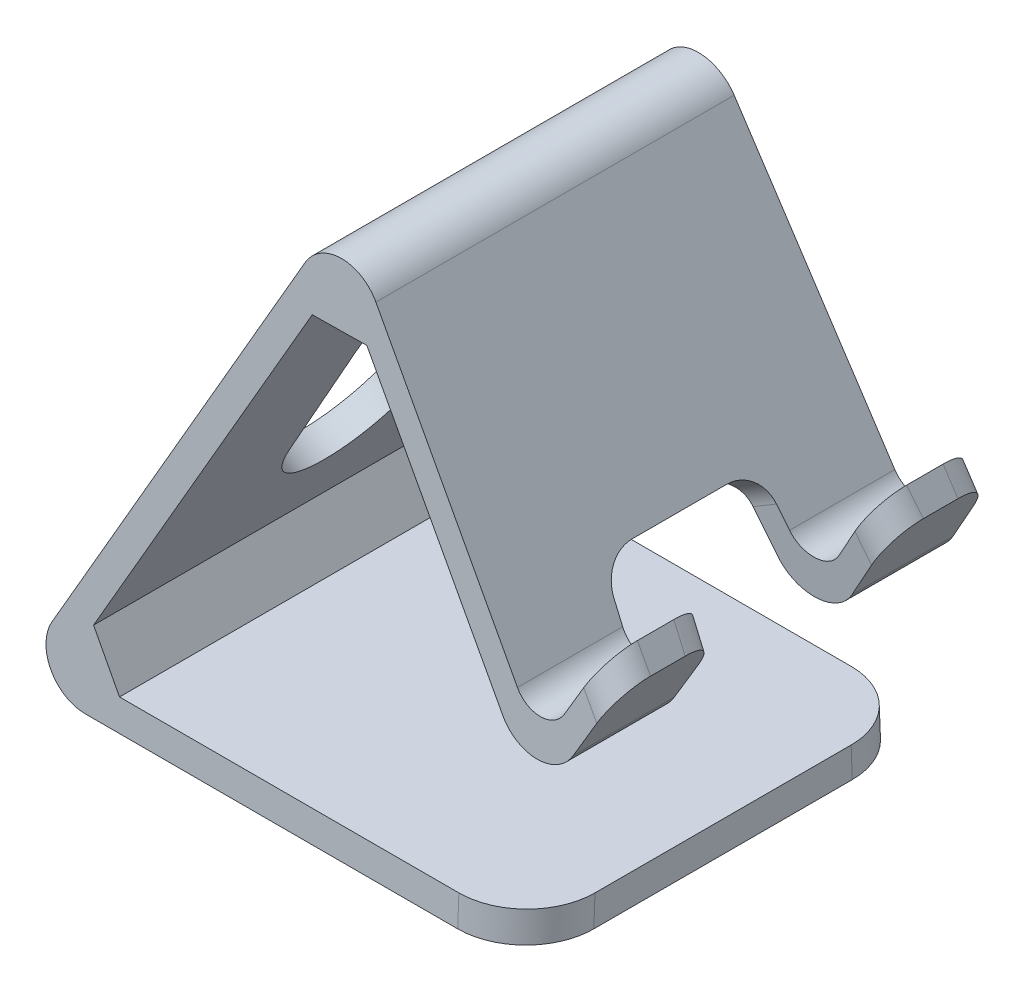
from build123d import *

# Parameters (mm, degrees)
EXTRUDE_3_DEPTH                 = 29
CUT_EXTRUDE_3_DEPTH             = 111.300725292
CUT_EXTRUDE_3_DEPTH_BACK        = 111.300725292
CUT_EXTRUDE_4_REACH             = 116.003
CUT_EXTRUDE_4_DIRECTION_2_DEPTH = 115.003022865
FILLET_3_R                      = 10
CHAMFER_2_SIZE                  = 8
FILLET_4_R                      = 6
FILLET_5_R                      = 4
FILLET_6_R                      = 6
FILLET_7_R                      = 5
SKETCH_35_R                     = 7.5
EXTRUDE_5_DEPTH                 = 1
CUT_EXTRUDE_5_REACH             = 84.551
CUT_EXTRUDE_6_DEPTH             = 0.3
FILLET_8_R                      = 5


with BuildPart() as part:
    # 草图32 → 凸台-拉伸3 (new, symmetric)
    with BuildSketch(Plane.XY):
        Polygon((0, 0), (-67.879360062, 0), (-29.899455763, 67.519829865), (0.761981995, 16.087740722), (11.931206305, 35.433404708), (9.878101375, 38.877322655), (1, 23.5), (-30, 75.5), (-75, -4.5), (0, -4.5), align=None)
    extrude(amount=EXTRUDE_3_DEPTH, both=True)

    # 草图33 → 切除-拉伸3 (cut, two sides: drawn at the far end of the back side and taken through both)
    with BuildSketch(Plane(origin=(0, 0, 0), x_dir=(0, 0, -1), z_dir=(1, 0, 0)).offset(-CUT_EXTRUDE_3_DEPTH_BACK)):
        Polygon((-29, -4.5), (-26, 75.5), (-29, 75.5), align=None)
        Polygon((29, 75.5), (29, -4.5), (26, 75.5), align=None)
    extrude(amount=CUT_EXTRUDE_3_DEPTH + CUT_EXTRUDE_3_DEPTH_BACK, mode=Mode.SUBTRACT)

    # 草图34 → 切除-拉伸4 (cut, up to next)
    with BuildSketch(Plane(origin=(11.073942701, 6.601773533, 0), x_dir=(0, 0, -1), z_dir=(0.8589469742085631, 0.5120645423166438, 0)), mode=Mode.PRIVATE) as cut_extrude_4_sk1:
        Polygon((11.5, 34.134738616), (-11.5, 34.134738616), (-14, 9.134738616), (14, 9.134738616), align=None)
    cut_extrude_4_tool1 = extrude(cut_extrude_4_sk1.sketch, amount=-CUT_EXTRUDE_4_REACH, mode=Mode.PRIVATE) & part.part
    add(cut_extrude_4_tool1.solids().sort_by_distance((0.204737, 24.83399, 0))[0], mode=Mode.SUBTRACT)

    # 草图34 → 切除-拉伸4 direction 2 (cut)
    with BuildSketch(Plane(origin=(11.073942701, 6.601773533, 0), x_dir=(0, 0, -1), z_dir=(0.8589469742085631, 0.5120645423166438, 0))):
        Polygon((11.5, 34.134738616), (-11.5, 34.134738616), (-14, 9.134738616), (14, 9.134738616), align=None)
    extrude(amount=CUT_EXTRUDE_4_DIRECTION_2_DEPTH, mode=Mode.SUBTRACT)

    # 圆角3
    fillet_3_edges = [part.edges().sort_by_distance(p)[0] for p in [
        (0, -2.25, 28.915625),
        (0, -2.25, -28.915625),
    ]]
    fillet(fillet_3_edges, radius=FILLET_3_R)

    # 倒角2
    chamfer_2_edges = [part.edges().sort_by_distance(p)[0] for p in [
        (-29.899455763, 67.519829865, 0),
        (-67.879360062, 0, 0),
    ]]
    chamfer(chamfer_2_edges, length=CHAMFER_2_SIZE)

    # 圆角4
    fillet_4_edges = [part.edges().sort_by_distance(p)[0] for p in [
        (-75, -4.5, 0),
        (-30, 75.5, 0),
    ]]
    fillet(fillet_4_edges, radius=FILLET_4_R)

    # 圆角5
    fillet_5_edges = [part.edges().sort_by_distance(p)[0] for p in [
        (1, 23.5, 20.448077463),
        (1, 23.5, -20.448077463),
    ]]
    fillet(fillet_5_edges, radius=FILLET_5_R)

    # 圆角6
    fillet_6_edges = [part.edges().sort_by_distance(p)[0] for p in [
        (0.761981995, 16.087740722, -20.89930018),
        (0.761981995, 16.087740722, 20.89930018),
    ]]
    fillet(fillet_6_edges, radius=FILLET_6_R)

    # 圆角7
    fillet_7_edges = [part.edges().sort_by_distance(p)[0] for p in [
        (10.90465384, 37.155363682, -12.280413798),
        (10.90465384, 37.155363682, 12.280413798),
        (10.90465384, 37.155363682, 27.437923862),
        (10.90465384, 37.155363682, -27.437923862),
    ]]
    fillet(fillet_7_edges, radius=FILLET_7_R)

    # 草图35 → 凸台-拉伸5 (add)
    with BuildSketch(Plane.XZ.offset(4.5)):
        with Locations(Location((-10, 18.99297122, 0), (0, 0, 180))):
            Circle(SKETCH_35_R)
        with Locations(Location((-10, -18.99297122, 0), (0, 0, 180))):
            Circle(SKETCH_35_R)
        with Locations(Location((-58, 0, 0), (0, 0, 153.999298512))):
            Circle(SKETCH_35_R)
    extrude(amount=EXTRUDE_5_DEPTH)

    # 草图36 → 切除-拉伸5 (cut, up to next)
    with BuildSketch(Plane(origin=(-55.050445104, 30.965875371, 0), x_dir=(0, 0, 1), z_dir=(-0.8715755371245495, 0.4902612396325589, 0)), mode=Mode.PRIVATE) as cut_extrude_5_sk1:
        with BuildLine():
            Line((-10, -4.432597983), (-10, 15.567402017))
            ThreePointArc((-10, 15.567402017), (0, 25.567402017), (10, 15.567402017))
            Line((10, 15.567402017), (10, -4.432597983))
            ThreePointArc((10, -4.432597983), (0, -14.432597983), (-10, -4.432597983))
        make_face()
    cut_extrude_5_tool1 = extrude(cut_extrude_5_sk1.sketch, amount=-CUT_EXTRUDE_5_REACH, mode=Mode.PRIVATE) & part.part
    add(cut_extrude_5_tool1.solids().sort_by_distance((-52.320964, 35.818287, 0))[0], mode=Mode.SUBTRACT)

    # 草图37 → 切除-拉伸6 (cut)
    # profile 1 of 9: a face of its own
    with BuildSketch(Plane(origin=(-55.050445104, 30.965875371, 0), x_dir=(0, 0, 1), z_dir=(-0.8715755371245495, 0.4902612396325589, 0))):
        with BuildLine():
            add(Edge.make_bspline(
                [(-20.577151535, -24.161056565), (-20.533698736, -24.180021175), (-20.449388162, -24.216817818), (-20.326063592, -24.269691503), (-20.212219188, -24.324608917), (-20.104417026, -24.374114264), (-20.005772568, -24.424792326), (-19.914430772, -24.471833581), (-19.831159115, -24.518084465), (-19.755908131, -24.562238869), (-19.688887539, -24.605663682), (-19.628790901, -24.645917921), (-19.577130111, -24.685759151), (-19.533162953, -24.723523468), (-19.49645027, -24.759210579), (-19.468817112, -24.794430448), (-19.446684682, -24.826703447), (-19.431528433, -24.867730076), (-19.423279731, -24.915620201), (-19.43127713, -24.970171327), (-19.456719968, -25.018661373), (-19.500015559, -25.058845231), (-19.55833581, -25.092563038), (-19.632591072, -25.119642128), (-19.722537814, -25.14278485), (-19.788807695, -25.151169154), (-19.824463363, -25.155680221)],
                knots=[0, 0, 0, 0, 1.774887606, 3.443777933, 5.02216885, 6.506002591, 7.883908503, 9.173098353, 10.352037023, 11.449334784, 12.438401237, 13.341234265, 14.15628658, 14.878570098, 15.511079307, 16.067930716, 16.553884613, 16.966866014, 17.696061493, 18.349692126, 18.994287051, 19.705914136, 20.530474227, 21.501826033, 22.655889223, 24, 24, 24, 24], degree=3))
            add(Edge.make_bspline(
                [(-19.824463363, -25.155680221), (-19.881262256, -25.158409338), (-19.992600424, -25.163758999), (-20.156357416, -25.142127882), (-20.312402176, -25.102379732), (-20.454916814, -25.038583312), (-20.581311083, -24.96827569), (-20.689081345, -24.901098856), (-20.777660287, -24.842105038), (-20.824814406, -24.798774935), (-20.84596874, -24.779336135)],
                knots=[0, 0, 0, 0, 1.217403643, 2.386375575, 3.52764692, 4.659534099, 5.723583622, 6.628270432, 7.384613155, 8, 8, 8, 8], degree=3))
            add(Edge.make_bspline(
                [(-20.84596874, -24.779336135), (-20.883791837, -24.75873807), (-20.954344751, -24.720315686), (-21.052160946, -24.66744506), (-21.135437816, -24.625045327), (-21.223680795, -24.583814196), (-21.321397382, -24.545361528), (-21.400170331, -24.539954043), (-21.437366589, -24.537400652)],
                knots=[0, 0, 0, 0, 1.201894061, 2.241940397, 3.103486451, 3.807931023, 4.964914167, 6, 6, 6, 6], degree=3))
            add(Edge.make_bspline(
                [(-21.437366589, -24.537400652), (-21.46532298, -24.542314589), (-21.518656444, -24.551689093), (-21.593827301, -24.571314096), (-21.660275378, -24.596264549), (-21.718677148, -24.626002449), (-21.768707295, -24.661111286), (-21.811457782, -24.699905274), (-21.844986417, -24.744169699), (-21.874430393, -24.806714911), (-21.901096351, -24.879951814), (-21.920934684, -24.958177594), (-21.931729451, -25.022468374), (-21.924410424, -25.059138299), (-21.921237557, -25.07503506)],
                knots=[0, 0, 0, 0, 1.253772988, 2.391870157, 3.426676515, 4.384111771, 5.278990028, 6.119356088, 6.925780205, 7.712639467, 9.164499054, 10.359360526, 11.288767193, 12, 12, 12, 12], degree=3))
            add(Edge.make_bspline(
                [(-21.921237557, -25.07503506), (-21.91602272, -25.108059929), (-21.905789101, -25.172868077), (-21.877585575, -25.266158393), (-21.843885899, -25.355422852), (-21.797619673, -25.438238078), (-21.745561256, -25.517519335), (-21.682504164, -25.590456793), (-21.612211148, -25.659601154), (-21.505021712, -25.742260811), (-21.360791843, -25.833668384), (-21.176590625, -25.924859948), (-20.982337421, -25.996222888), (-20.780858961, -26.044598528), (-20.581936612, -26.079709841), (-20.393860887, -26.11320817), (-20.219268484, -26.141038013), (-20.083159719, -26.160864748), (-19.983427525, -26.172847709), (-19.919365361, -26.180728704), (-19.86394416, -26.187702266), (-19.817561106, -26.194022572), (-19.77965912, -26.19775412), (-19.750790995, -26.200780102), (-19.730882889, -26.202821152), (-19.720587616, -26.203741075), (-19.716936482, -26.204067318)],
                knots=[0, 0, 0, 0, 0.898623367, 1.763462446, 2.617537014, 3.460709655, 4.310290048, 5.165624348, 6.049797942, 6.959184706, 8.802372978, 10.635582049, 12.480500324, 14.358410556, 16.202810001, 17.916227113, 19.498958615, 20.9602227, 21.617091787, 22.201960264, 22.69710495, 23.120249123, 23.461486519, 23.721855746, 23.9013584, 24, 24, 24, 24], degree=3))
            add(Edge.make_bspline(
                [(-19.716936482, -26.204067318), (-19.657807347, -26.199292622), (-19.54262048, -26.189991245), (-19.375003316, -26.167464256), (-19.216397904, -26.141196398), (-19.067270747, -26.108303651), (-18.927378418, -26.070465619), (-18.796492483, -26.027972909), (-18.674659602, -25.979270223), (-18.562150285, -25.924478398), (-18.458568816, -25.864971165), (-18.361544674, -25.80484487), (-18.273040329, -25.740936577), (-18.191718686, -25.675003457), (-18.118125853, -25.606536576), (-18.051896997, -25.535352162), (-17.992951751, -25.462023255), (-17.927268023, -25.362475774), (-17.858011217, -25.240802252), (-17.789814808, -25.100761878), (-17.734419536, -24.972030929), (-17.701627842, -24.853716996), (-17.678643117, -24.753907942), (-17.661817566, -24.677250819), (-17.650621201, -24.625943387), (-17.647933144, -24.599808728), (-17.647044008, -24.591164092)],
                knots=[0, 0, 0, 0, 1.482743799, 2.888468025, 4.226507225, 5.500753656, 6.70429997, 7.84820434, 8.938974761, 9.981639598, 10.973661177, 11.924333879, 12.833821288, 13.700683987, 14.540115004, 15.344369087, 16.129568466, 16.888920077, 18.323435438, 19.625812196, 20.782879078, 21.819950517, 22.68931087, 23.343531176, 23.782857944, 24, 24, 24, 24], degree=3))
            add(Edge.make_bspline(
                [(-17.647044008, -24.591164092), (-17.6551991, -24.52659664), (-17.671003826, -24.401463669), (-17.712562809, -24.222771373), (-17.769498874, -24.059766919), (-17.840801985, -23.912465513), (-17.928137472, -23.781299742), (-18.031022042, -23.667131688), (-18.146807896, -23.56666747), (-18.277275665, -23.488163384), (-18.40816758, -23.420982022), (-18.530924751, -23.358722455), (-18.644745848, -23.306217689), (-18.748197, -23.260563647), (-18.842802396, -23.225007479), (-18.927241737, -23.196556058), (-19.002417241, -23.176798551), (-19.049800823, -23.169717009), (-19.071775191, -23.16643291)],
                knots=[0, 0, 0, 0, 1.428728713, 2.768903868, 4.020691245, 5.213804758, 6.353999944, 7.469010608, 8.580609074, 9.707115609, 10.802633804, 11.813160484, 12.729525166, 13.555507037, 14.296018834, 14.948338151, 15.512286654, 16, 16, 16, 16], degree=3))
            add(Edge.make_bspline(
                [(-19.071775191, -23.16643291), (-19.152609579, -23.144519048), (-19.306486232, -23.102803736), (-19.522524896, -23.033333506), (-19.712293687, -22.962343051), (-19.875320978, -22.888853622), (-20.012550393, -22.814610237), (-20.125048963, -22.739881712), (-20.210701568, -22.661370073), (-20.2688431, -22.580783829), (-20.302928294, -22.504165683), (-20.315223026, -22.433308829), (-20.303337689, -22.368717853), (-20.265083247, -22.314307669), (-20.204961237, -22.271187654), (-20.123983685, -22.238500289), (-20.022111024, -22.212995391), (-19.946417896, -22.203741349), (-19.905108525, -22.198690974)],
                knots=[0, 0, 0, 0, 1.988683335, 3.785665266, 5.386987976, 6.797796633, 8.028715669, 9.088924144, 9.997716808, 10.771873961, 11.432103058, 11.97378321, 12.456015068, 12.950017393, 13.512731618, 14.190553816, 15.012498408, 16, 16, 16, 16], degree=3))
            add(Edge.make_bspline(
                [(-19.905108525, -22.198690974), (-19.818475277, -22.214038128), (-19.650098582, -22.243866204), (-19.409786361, -22.313590695), (-19.189644632, -22.404520385), (-19.056378051, -22.482897681), (-18.99113003, -22.521271619)],
                knots=[0, 0, 0, 0, 1.081052697, 2.10108805, 3.07028268, 4, 4, 4, 4], degree=3))
            add(Edge.make_bspline(
                [(-18.99113003, -22.521271619), (-18.950507343, -22.54031721), (-18.873604122, -22.576372611), (-18.761745923, -22.620394919), (-18.662119723, -22.657752537), (-18.5724536, -22.68257737), (-18.49353064, -22.698398004), (-18.425440499, -22.703806707), (-18.367115464, -22.700777153), (-18.334177955, -22.688285313), (-18.319087019, -22.682561942)],
                knots=[0, 0, 0, 0, 1.523356601, 2.883881869, 4.081874323, 5.134743613, 6.041122103, 6.809671018, 7.454628489, 8, 8, 8, 8], degree=3))
            add(Edge.make_bspline(
                [(-18.319087019, -22.682561942), (-18.281236744, -22.6708687), (-18.209725343, -22.648776387), (-18.113235561, -22.603331684), (-18.031405772, -22.552622753), (-17.968770462, -22.490298784), (-17.92096247, -22.421970131), (-17.893020123, -22.344482048), (-17.880335723, -22.260010481), (-17.886019483, -22.202013258), (-17.888979492, -22.171809254)],
                knots=[0, 0, 0, 0, 1.280561225, 2.419393964, 3.444275322, 4.378522804, 5.260357978, 6.120267197, 7.021065954, 8, 8, 8, 8], degree=3))
            add(Edge.make_bspline(
                [(-17.888979492, -22.171809254), (-17.894122182, -22.143494623), (-17.904276889, -22.087584817), (-17.927975335, -22.006566356), (-17.960684923, -21.930803978), (-17.997913924, -21.858298726), (-18.044346195, -21.791621312), (-18.09725498, -21.729093391), (-18.158619855, -21.672774418), (-18.248284038, -21.602014759), (-18.370920715, -21.524473365), (-18.527358529, -21.442395651), (-18.694945507, -21.376409334), (-18.870011692, -21.324011413), (-19.046911368, -21.281209822), (-19.220701199, -21.244829048), (-19.389402032, -21.212704495), (-19.549861886, -21.191613462), (-19.694264284, -21.173984807), (-19.815006392, -21.16051792), (-19.909346168, -21.153269415), (-19.963180192, -21.151180002), (-19.985753686, -21.150303877)],
                knots=[0, 0, 0, 0, 0.688172393, 1.358858791, 2.013519245, 2.659847141, 3.305052642, 3.952598325, 4.615391518, 5.293600567, 6.683116416, 8.078584176, 9.51447638, 10.983606409, 12.446976471, 13.867001244, 15.231064589, 16.553652177, 17.73727095, 18.711302852, 19.459628046, 20, 20, 20, 20], degree=3))
            add(Edge.make_bspline(
                [(-19.985753686, -21.150303877), (-20.044551404, -21.155079627), (-20.159077021, -21.164381784), (-20.325373557, -21.186843257), (-20.482030192, -21.213009902), (-20.628413994, -21.246223731), (-20.765075177, -21.283189746), (-20.891068181, -21.327766914), (-21.00785098, -21.375460882), (-21.113884286, -21.431285984), (-21.211348838, -21.489895046), (-21.301330156, -21.551278513), (-21.385333642, -21.613269209), (-21.461271517, -21.679469566), (-21.530230033, -21.748238887), (-21.592036324, -21.819635921), (-21.64594016, -21.894011876), (-21.708195614, -21.992759599), (-21.771358827, -22.115005216), (-21.837557486, -22.25387757), (-21.886224346, -22.384009592), (-21.917021074, -22.485563266), (-21.932381758, -22.55946927), (-21.943220684, -22.605676952), (-21.949615315, -22.645064684), (-21.955087982, -22.677038683), (-21.957616595, -22.702287279), (-21.956573523, -22.719534371), (-21.954851164, -22.732013763), (-21.949973535, -22.735137773), (-21.948119277, -22.736325383)],
                knots=[0, 0, 0, 0, 1.774356887, 3.456074856, 5.046558592, 6.550719618, 7.970155971, 9.302624251, 10.569046576, 11.761319072, 12.903375071, 13.988869614, 15.03717987, 16.042138367, 17.016375378, 17.96500419, 18.879608563, 19.777050202, 21.474314427, 23.015365352, 24.402410001, 25.650398401, 26.202680859, 26.672667392, 27.078092708, 27.401454185, 27.651849304, 27.83183675, 27.936071802, 28, 28, 28, 28], degree=3))
            add(Edge.make_bspline(
                [(-21.948119277, -22.736325383), (-21.944521544, -22.79451127), (-21.93755815, -22.907129737), (-21.910299844, -23.069113708), (-21.871275889, -23.21830785), (-21.81752512, -23.353987932), (-21.749201909, -23.475669831), (-21.667887801, -23.58410993), (-21.573920699, -23.680420006), (-21.429669119, -23.784575875), (-21.242818402, -23.893996222), (-21.019525062, -24.008052281), (-20.79885012, -24.098363341), (-20.649935212, -24.140474371), (-20.577151535, -24.161056565)],
                knots=[0, 0, 0, 0, 0.973159169, 1.883544272, 2.73872542, 3.54470359, 4.314090907, 5.062422852, 5.803244051, 6.551575996, 8.026035828, 9.416760423, 10.737415365, 12, 12, 12, 12], degree=3))
        make_face()
    # profile 2 of 9: a face of its own
    with BuildSketch(Plane(origin=(-55.050445104, 30.965875371, 0), x_dir=(0, 0, 1), z_dir=(-0.8715755371245495, 0.4902612396325589, 0))):
        with BuildLine():
            add(Edge.make_bspline(
                [(-17.37026185, -23.730949039), (-17.367102181, -23.803019576), (-17.360943425, -23.943497844), (-17.33821229, -24.148120081), (-17.303103659, -24.340522334), (-17.258670362, -24.521681917), (-17.203144173, -24.691279233), (-17.13639066, -24.849234494), (-17.058877062, -24.995527053), (-16.969250216, -25.128767404), (-16.873764143, -25.251931925), (-16.773910934, -25.365569744), (-16.671248951, -25.470304817), (-16.565870072, -25.566572899), (-16.455897014, -25.652089327), (-16.343228651, -25.728993475), (-16.227384708, -25.797398942), (-16.071016295, -25.872837942), (-15.880067302, -25.951994827), (-15.660316311, -26.028245106), (-15.456501639, -26.088501338), (-15.295586914, -26.118639513), (-15.178588487, -26.135801794), (-15.103607782, -26.146925833), (-15.038905567, -26.156006595), (-14.984725605, -26.162676002), (-14.941216484, -26.168392022), (-14.908560509, -26.17431519), (-14.885858144, -26.175854599), (-14.874243286, -26.176845819), (-14.87026185, -26.177185598)],
                knots=[0, 0, 0, 0, 1.553776883, 3.028586922, 4.430914777, 5.764338375, 7.043970201, 8.27093092, 9.454357098, 10.604423334, 11.725570996, 12.809727652, 13.861288246, 14.883718713, 15.881967172, 16.859572294, 17.820885932, 18.776894516, 20.597226299, 22.27038548, 23.786652246, 25.170543426, 25.792371545, 26.334308418, 26.803448893, 27.19983445, 27.510234347, 27.74885525, 27.913910558, 28, 28, 28, 28], degree=3))
            add(Edge.make_bspline(
                [(-14.87026185, -26.177185598), (-14.798159394, -26.172064079), (-14.657544585, -26.162076049), (-14.453353839, -26.13325123), (-14.260336518, -26.098175844), (-14.079157179, -26.05293934), (-13.91031154, -25.996351781), (-13.752215344, -25.933506836), (-13.606445134, -25.859583683), (-13.472483159, -25.776436164), (-13.34970694, -25.686270611), (-13.234498431, -25.59387626), (-13.128761004, -25.497090176), (-13.031801514, -25.396470297), (-12.944056519, -25.291381569), (-12.86421643, -25.183421788), (-12.794125163, -25.070979796), (-12.713991269, -24.919373928), (-12.630015302, -24.732770443), (-12.54554009, -24.517525112), (-12.480624108, -24.315873906), (-12.443541723, -24.155833675), (-12.422765376, -24.037590177), (-12.408091298, -23.960109419), (-12.398030946, -23.891155037), (-12.387086926, -23.83167276), (-12.38086167, -23.780353826), (-12.374270121, -23.738371831), (-12.371117644, -23.704779817), (-12.370519279, -23.685486148), (-12.37026185, -23.677185598)],
                knots=[0, 0, 0, 0, 1.546972858, 3.016919322, 4.411738793, 5.745419676, 7.010281416, 8.221386372, 9.384270769, 10.504104324, 11.59264842, 12.64339523, 13.664197013, 14.659081761, 15.632399286, 16.592980194, 17.531313248, 18.465765313, 20.262025915, 21.908555878, 23.413974024, 24.792632945, 25.421090786, 25.984097791, 26.480499038, 26.912649357, 27.278376264, 27.586829729, 27.822245279, 28, 28, 28, 28], degree=3))
            add(Edge.make_bspline(
                [(-12.37026185, -23.677185598), (-12.377479236, -23.607066892), (-12.391552294, -23.470343635), (-12.424719242, -23.27125756), (-12.466728603, -23.083713421), (-12.514638185, -22.905925084), (-12.574120436, -22.740202132), (-12.638899504, -22.584117476), (-12.714133595, -22.439727993), (-12.798055356, -22.306853743), (-12.887173095, -22.183039186), (-12.979479259, -22.067640277), (-13.075453841, -21.960521456), (-13.174734582, -21.861955845), (-13.277783841, -21.772223559), (-13.383236572, -21.689900276), (-13.493108055, -21.617301808), (-13.641157706, -21.532931599), (-13.824596813, -21.442619318), (-14.041401258, -21.354708377), (-14.249265977, -21.28630937), (-14.418178347, -21.250234001), (-14.544692155, -21.22963924), (-14.629798243, -21.214772682), (-14.707368088, -21.204809516), (-14.776839622, -21.193802079), (-14.838438031, -21.18779435), (-14.891707785, -21.180844079), (-14.937266589, -21.177991343), (-14.965175534, -21.1774364), (-14.977788732, -21.177185598)],
                knots=[0, 0, 0, 0, 1.480065234, 2.885953728, 4.235338451, 5.515353872, 6.749777685, 7.930335995, 9.061923053, 10.164175931, 11.227968694, 12.264189459, 13.266090289, 14.246822847, 15.200128831, 16.134157481, 17.054274929, 17.962837493, 19.711440014, 21.343469629, 22.873131194, 24.300382777, 24.964946675, 25.565343307, 26.11435036, 26.607174569, 27.042034341, 27.413781935, 27.735064012, 28, 28, 28, 28], degree=3))
            add(Edge.make_bspline(
                [(-14.977788732, -21.177185598), (-15.047576513, -21.184751826), (-15.183659146, -21.199505586), (-15.381556598, -21.233348554), (-15.567247956, -21.277192587), (-15.741821728, -21.328673963), (-15.904545281, -21.389998613), (-16.055010163, -21.462518196), (-16.195473287, -21.541033642), (-16.321817894, -21.631969477), (-16.438376595, -21.728358574), (-16.547941474, -21.827154781), (-16.64851349, -21.930609874), (-16.742924199, -22.035509712), (-16.827084833, -22.145906853), (-16.905337511, -22.257830911), (-16.974192429, -22.374312742), (-17.054169425, -22.529949854), (-17.137021105, -22.721637081), (-17.222954424, -22.940609763), (-17.287233118, -23.145515518), (-17.325323427, -23.306254742), (-17.344432105, -23.42368264), (-17.358327859, -23.498420824), (-17.367104065, -23.562929573), (-17.37288686, -23.616732795), (-17.377370431, -23.659896312), (-17.378800278, -23.692712909), (-17.37724492, -23.71608861), (-17.372107164, -23.72702209), (-17.37026185, -23.730949039)],
                knots=[0, 0, 0, 0, 1.527625601, 2.978792395, 4.366456512, 5.678254858, 6.9379672, 8.146349649, 9.311088139, 10.435458783, 11.528677104, 12.602512933, 13.644537105, 14.667917464, 15.672074197, 16.6638922, 17.638837348, 18.614504728, 20.470806477, 22.181182263, 23.732465541, 25.14123255, 25.771823501, 26.32165675, 26.795657213, 27.188121307, 27.500068564, 27.738550233, 27.906095781, 28, 28, 28, 28], degree=3))
        make_face()
        with BuildLine():
            add(Edge.make_bspline(
                [(-14.010046796, -23.730949039), (-14.017497257, -23.775922618), (-14.03171597, -23.861751719), (-14.065461118, -23.982493321), (-14.109207811, -24.088312654), (-14.160933897, -24.180841172), (-14.223250732, -24.258932914), (-14.295801527, -24.321915334), (-14.376627011, -24.37269436), (-14.465570074, -24.403824475), (-14.551950892, -24.426668993), (-14.629349267, -24.448297483), (-14.696229273, -24.464080968), (-14.751904378, -24.476064157), (-14.797173204, -24.484821064), (-14.8310688, -24.487975268), (-14.855496429, -24.491035732), (-14.866344493, -24.485600084), (-14.87026185, -24.483637211)],
                knots=[0, 0, 0, 0, 1.712899385, 3.268955102, 4.700819982, 6.008423881, 7.241784637, 8.435382156, 9.605803375, 10.806097966, 11.959438673, 12.967220294, 13.826618187, 14.541136063, 15.111359936, 15.550863162, 15.837811697, 16, 16, 16, 16], degree=3))
            add(Edge.make_bspline(
                [(-14.87026185, -24.483637211), (-14.919454391, -24.480427197), (-15.012927804, -24.474327676), (-15.14533432, -24.453654991), (-15.262769172, -24.423387414), (-15.365174542, -24.382576132), (-15.45351976, -24.332974284), (-15.526565132, -24.272453817), (-15.584846805, -24.202108306), (-15.624014395, -24.122746724), (-15.652514261, -24.044713073), (-15.679145283, -23.973936963), (-15.69966519, -23.911710979), (-15.716188295, -23.858441158), (-15.727223567, -23.814163007), (-15.733474493, -23.778724), (-15.736123078, -23.751531), (-15.732106257, -23.736888511), (-15.730476904, -23.730949039)],
                knots=[0, 0, 0, 0, 1.831842129, 3.480782507, 4.973997201, 6.330206663, 7.56813816, 8.724382464, 9.838050106, 10.936096934, 11.9945506, 12.927348455, 13.746610315, 14.429607136, 15.001109856, 15.439197481, 15.772520167, 16, 16, 16, 16], degree=3))
            add(Edge.make_bspline(
                [(-15.730476904, -23.730949039), (-15.722903488, -23.686006329), (-15.708411756, -23.600008441), (-15.676124712, -23.478472662), (-15.633071999, -23.371465632), (-15.582577403, -23.27750097), (-15.522430161, -23.197531818), (-15.452944313, -23.132141666), (-15.374937349, -23.079503773), (-15.289040403, -23.045235992), (-15.20487189, -23.019194648), (-15.128759472, -22.994842516), (-15.062020388, -22.975933552), (-15.005018016, -22.96145509), (-14.95734899, -22.952657959), (-14.919624573, -22.947187839), (-14.891163825, -22.945838287), (-14.87620242, -22.949804373), (-14.87026185, -22.951379146)],
                knots=[0, 0, 0, 0, 1.692354232, 3.238320295, 4.659761036, 5.967171196, 7.189970578, 8.358443901, 9.496883806, 10.662232167, 11.777071406, 12.771238182, 13.629671299, 14.353157426, 14.95513427, 15.427574087, 15.772712761, 16, 16, 16, 16], degree=3))
            add(Edge.make_bspline(
                [(-14.87026185, -22.951379146), (-14.823292016, -22.958456943), (-14.733230903, -22.972028085), (-14.60659006, -23.00559296), (-14.49342709, -23.044518282), (-14.394231193, -23.092214489), (-14.310181495, -23.149436849), (-14.238579682, -23.213256757), (-14.183091817, -23.287035174), (-14.143917915, -23.36667045), (-14.113777107, -23.444021223), (-14.086965238, -23.513542865), (-14.064110007, -23.573297812), (-14.044888237, -23.623292783), (-14.030197941, -23.663887233), (-14.019010149, -23.694530958), (-14.012277869, -23.715772994), (-14.010634653, -23.726950359), (-14.010046796, -23.730949039)],
                knots=[0, 0, 0, 0, 1.802693797, 3.456529425, 4.967354779, 6.342727495, 7.622182418, 8.817616725, 9.969605447, 11.102614931, 12.176898173, 13.122518101, 13.932403246, 14.606558496, 15.156811523, 15.571397513, 15.846668336, 16, 16, 16, 16], degree=3))
        make_face(mode=Mode.SUBTRACT)
    # profile 3 of 9: a face of its own
    with BuildSketch(Plane(origin=(-55.050445104, 30.965875371, 0), x_dir=(0, 0, 1), z_dir=(-0.8715755371245495, 0.4902612396325589, 0))):
        with BuildLine():
            add(Edge.make_bspline(
                [(-10.808135207, -26.096540436), (-10.615374038, -26.107917768), (-10.230410927, -26.130639423), (-9.651889734, -26.13921634), (-9.073697749, -26.130679762), (-8.688736434, -26.107918183), (-8.49630725, -26.096540436)],
                knots=[0, 0, 0, 0, 1.001452169, 1.999998981, 3.000266913, 4, 4, 4, 4], degree=3))
            add(Edge.make_bspline(
                [(-8.49630725, -26.096540436), (-8.462002282, -26.091546404), (-8.396135147, -26.081957629), (-8.303512765, -26.057906165), (-8.220592916, -26.028062833), (-8.147434872, -25.991793722), (-8.084629258, -25.947088131), (-8.031426908, -25.896507862), (-7.988439451, -25.838617993), (-7.958065477, -25.77519322), (-7.934588276, -25.712305588), (-7.913049562, -25.6550868), (-7.893272744, -25.605066985), (-7.878959783, -25.561258807), (-7.866164546, -25.524415931), (-7.858817579, -25.493942126), (-7.852996337, -25.470484919), (-7.85169421, -25.457040018), (-7.85114596, -25.451379146)],
                knots=[0, 0, 0, 0, 1.663944611, 3.194851055, 4.586587203, 5.891069036, 7.102864668, 8.275233047, 9.403766185, 10.544279721, 11.639452055, 12.628194084, 13.480752984, 14.221709714, 14.841700061, 15.352002209, 15.727165508, 16, 16, 16, 16], degree=3))
            add(Edge.make_bspline(
                [(-7.85114596, -25.451379146), (-7.855959915, -25.419097933), (-7.865156326, -25.357429047), (-7.886186746, -25.270171979), (-7.911975438, -25.192177597), (-7.942117312, -25.122688939), (-7.979643628, -25.063752517), (-8.020450862, -25.012536928), (-8.067642197, -24.971550596), (-8.135014688, -24.930085787), (-8.220499629, -24.894639641), (-8.317633173, -24.858742396), (-8.409155467, -24.838087603), (-8.468346632, -24.834699868), (-8.49630725, -24.833099576)],
                knots=[0, 0, 0, 0, 1.181124661, 2.256378659, 3.24417669, 4.152977562, 4.989669679, 5.766515604, 6.515839546, 7.239190092, 8.621292976, 9.85618663, 10.987309236, 12, 12, 12, 12], degree=3))
            add(Edge.make_bspline(
                [(-8.49630725, -24.833099576), (-8.539110382, -24.834651842), (-8.622374549, -24.837671437), (-8.74463397, -24.838357652), (-8.860846101, -24.831774161), (-8.971544298, -24.822375477), (-9.076251658, -24.807450222), (-9.175355146, -24.787616113), (-9.268343417, -24.762702062), (-9.356001876, -24.734403754), (-9.436643546, -24.698753854), (-9.512645409, -24.660427398), (-9.582585465, -24.61678609), (-9.645803348, -24.567208433), (-9.70381453, -24.513598556), (-9.755848231, -24.454543604), (-9.801543039, -24.390656418), (-9.842399352, -24.321440849), (-9.877894952, -24.244693183), (-9.911962322, -24.160112102), (-9.942519163, -24.06581102), (-9.971259128, -23.962143761), (-9.998133649, -23.848951777), (-10.021721379, -23.725955089), (-10.043422136, -23.593797501), (-10.063552491, -23.452444669), (-10.080110423, -23.301648376), (-10.094947537, -23.141326549), (-10.108218342, -22.971418886), (-10.117204476, -22.792100529), (-10.127420326, -22.603671063), (-10.130979518, -22.405449307), (-10.135961328, -22.197718763), (-10.136047968, -22.05598941), (-10.136092196, -21.983637211)],
                knots=[0, 0, 0, 0, 1.055864871, 2.053955041, 3.012397676, 3.924173828, 4.791907018, 5.618194783, 6.413948121, 7.164201475, 7.886085029, 8.584932055, 9.261343543, 9.914293149, 10.562613672, 11.20601181, 11.850812764, 12.496236213, 13.184224547, 13.933183244, 14.742943584, 15.62623365, 16.584676285, 17.609924255, 18.712791558, 19.885969113, 21.129114476, 22.451970491, 23.85496981, 25.329832633, 26.877806384, 28.506352517, 30.216508636, 32, 32, 32, 32], degree=3))
            add(Edge.make_bspline(
                [(-10.136092196, -21.983637211), (-10.1432537, -21.938679873), (-10.15701616, -21.852284098), (-10.189647037, -21.730358273), (-10.23170826, -21.622556285), (-10.27996313, -21.526775744), (-10.33948442, -21.446086788), (-10.405379239, -21.37671989), (-10.481190279, -21.321623904), (-10.564636919, -21.284302296), (-10.645112512, -21.254346753), (-10.717393449, -21.226914063), (-10.779623753, -21.204478857), (-10.83161923, -21.185271013), (-10.87347474, -21.170415891), (-10.905113417, -21.159173396), (-10.927062226, -21.152624367), (-10.938547981, -21.1509028), (-10.942543809, -21.150303877)],
                knots=[0, 0, 0, 0, 1.730864127, 3.326250023, 4.789027176, 6.127155282, 7.392132229, 8.588351159, 9.754964298, 10.929405087, 12.052310267, 13.022991073, 13.869598799, 14.56845487, 15.131430886, 15.558575806, 15.846431069, 16, 16, 16, 16], degree=3))
            add(Edge.make_bspline(
                [(-10.942543809, -21.150303877), (-10.985140589, -21.157333678), (-11.066583854, -21.170774363), (-11.181203772, -21.199453282), (-11.28261615, -21.234152465), (-11.370848758, -21.274452826), (-11.445740716, -21.321501354), (-11.507127637, -21.374283034), (-11.556065877, -21.43314065), (-11.598591786, -21.5192195), (-11.634441657, -21.626598645), (-11.663167478, -21.751703516), (-11.676948926, -21.870301336), (-11.671145286, -21.946796999), (-11.668350261, -21.983637211)],
                knots=[0, 0, 0, 0, 1.231991866, 2.355517079, 3.368132707, 4.287815785, 5.118277187, 5.883792895, 6.590992546, 7.285903267, 8.610122209, 9.814376477, 10.947406576, 12, 12, 12, 12], degree=3))
            add(Edge.make_bspline(
                [(-11.668350261, -21.983637211), (-11.679731198, -22.248430328), (-11.702542934, -22.779176661), (-11.711019391, -23.577624651), (-11.702429313, -24.379383433), (-11.679726334, -24.914449506), (-11.668350261, -25.182561942)],
                knots=[0, 0, 0, 0, 0.993780792, 1.991915491, 2.993783282, 4, 4, 4, 4], degree=3))
            add(Edge.make_bspline(
                [(-11.668350261, -25.182561942), (-11.6629595, -25.235724974), (-11.652675349, -25.337146028), (-11.628952469, -25.480673221), (-11.594499249, -25.606965822), (-11.555026053, -25.717733067), (-11.504901877, -25.811017616), (-11.448162431, -25.888889445), (-11.38169918, -25.949152754), (-11.284805187, -26.002370115), (-11.165472757, -26.045146852), (-11.033321827, -26.083471088), (-10.915175559, -26.103559425), (-10.84202372, -26.098762618), (-10.808135207, -26.096540436)],
                knots=[0, 0, 0, 0, 1.336806891, 2.550275258, 3.633829093, 4.608500073, 5.485169028, 6.273922483, 7.008931374, 7.708181654, 9.024959663, 10.171148912, 11.152761654, 12, 12, 12, 12], degree=3))
        make_face()
    # profile 4 of 9: a face of its own
    with BuildSketch(Plane(origin=(-55.050445104, 30.965875371, 0), x_dir=(0, 0, 1), z_dir=(-0.8715755371245495, 0.4902612396325589, 0))):
        with BuildLine():
            add(Edge.make_bspline(
                [(-6.293001794, -25.397615705), (-6.281766389, -25.115229665), (-6.259314809, -24.550940909), (-6.24862273, -23.703735642), (-6.259286492, -22.856860943), (-6.281765746, -22.292573039), (-6.293001794, -22.010518931)],
                knots=[0, 0, 0, 0, 1.00085636, 1.999999684, 3.000318273, 4, 4, 4, 4], degree=3))
            add(Edge.make_bspline(
                [(-6.293001794, -22.010518931), (-6.302270389, -21.967534238), (-6.320126555, -21.884723213), (-6.356929854, -21.768041854), (-6.400608042, -21.66350355), (-6.451517616, -21.571457422), (-6.508308313, -21.49068098), (-6.572251284, -21.422161097), (-6.643833729, -21.366234219), (-6.721141977, -21.325478199), (-6.79565045, -21.292050239), (-6.862535329, -21.26223266), (-6.920032794, -21.2361115), (-6.968539278, -21.215326086), (-7.007823051, -21.199292855), (-7.03749789, -21.187316711), (-7.057960126, -21.17949173), (-7.068900347, -21.177765043), (-7.072571687, -21.177185598)],
                knots=[0, 0, 0, 0, 1.729165885, 3.331278834, 4.805622187, 6.178984715, 7.461464822, 8.680644533, 9.853214033, 11.01607612, 12.108495819, 13.06693283, 13.896783916, 14.592803599, 15.143171629, 15.565023261, 15.854029703, 16, 16, 16, 16], degree=3))
            add(Edge.make_bspline(
                [(-7.072571687, -21.177185598), (-7.117497338, -21.184169398), (-7.202922908, -21.197449009), (-7.323066182, -21.226483176), (-7.428992888, -21.260634644), (-7.5206119, -21.301451423), (-7.598470431, -21.348041908), (-7.66176032, -21.401233688), (-7.713118253, -21.459376347), (-7.755322198, -21.546244406), (-7.791405546, -21.653436981), (-7.820064067, -21.778595632), (-7.833861432, -21.897180733), (-7.828055829, -21.973677964), (-7.825259859, -22.010518931)],
                knots=[0, 0, 0, 0, 1.272642198, 2.419913408, 3.457288489, 4.384828457, 5.223164631, 5.988250439, 6.693851166, 7.375547344, 8.67458471, 9.855938671, 10.967422874, 12, 12, 12, 12], degree=3))
            add(Edge.make_bspline(
                [(-7.825259859, -22.010518931), (-7.835839484, -22.151524525), (-7.85698535, -22.433357329), (-7.877502676, -22.856960372), (-7.889260879, -23.280522878), (-7.893313193, -23.70406716), (-7.889280321, -24.127280647), (-7.87744972, -24.550840196), (-7.857026301, -24.974447489), (-7.835844865, -25.256610356), (-7.825259859, -25.397615705)],
                knots=[0, 0, 0, 0, 1.000861319, 2.000456459, 3.00157964, 4.000000961, 4.998422282, 5.997197275, 6.999138681, 8, 8, 8, 8], degree=3))
            add(Edge.make_bspline(
                [(-7.825259859, -25.397615705), (-7.820070625, -25.442545665), (-7.810203114, -25.527981578), (-7.783926683, -25.648169961), (-7.75149941, -25.754917662), (-7.706830088, -25.845996191), (-7.656394013, -25.924672682), (-7.595711925, -25.988115972), (-7.527151704, -26.038874549), (-7.450279181, -26.0705963), (-7.375176014, -26.093315225), (-7.307256252, -26.115613099), (-7.247730809, -26.134914985), (-7.196038558, -26.149329287), (-7.1534475, -26.161831886), (-7.119143653, -26.169678591), (-7.093299548, -26.175211065), (-7.078559084, -26.176615239), (-7.072571687, -26.177185598)],
                knots=[0, 0, 0, 0, 1.797407536, 3.417834167, 4.886953284, 6.220929248, 7.439808889, 8.58797721, 9.694115617, 10.804967703, 11.873381595, 12.816598882, 13.647192766, 14.361435767, 14.950604861, 15.411568026, 15.760986061, 16, 16, 16, 16], degree=3))
            add(Edge.make_bspline(
                [(-7.072571687, -26.177185598), (-7.029988793, -26.1722366), (-6.948272728, -26.162739533), (-6.83283453, -26.138167702), (-6.730415595, -26.105377013), (-6.641055254, -26.065669657), (-6.563546596, -26.019091841), (-6.50039638, -25.962604553), (-6.449103841, -25.899302245), (-6.403146531, -25.807673203), (-6.363993101, -25.697452143), (-6.323602037, -25.580639053), (-6.299692121, -25.482506516), (-6.295048693, -25.423587959), (-6.293001794, -25.397615705)],
                knots=[0, 0, 0, 0, 1.252866885, 2.404236606, 3.444431598, 4.39119037, 5.258223147, 6.076085271, 6.856484139, 7.624724624, 9.059069506, 10.27413246, 11.239209669, 12, 12, 12, 12], degree=3))
        make_face()
    # profile 5 of 9: a face of its own
    with BuildSketch(Plane(origin=(-55.050445104, 30.965875371, 0), x_dir=(0, 0, 1), z_dir=(-0.8715755371245495, 0.4902612396325589, 0))):
        with BuildLine():
            add(Edge.make_bspline(
                [(-3.13887993, -21.230949039), (-3.254611424, -21.219723022), (-3.484715774, -21.197402778), (-3.82983483, -21.18656439), (-4.171677169, -21.197126523), (-4.397438121, -21.219706267), (-4.509847672, -21.230949039)],
                knots=[0, 0, 0, 0, 1.015351919, 2.018784057, 3.01352474, 4, 4, 4, 4], degree=3))
            add(Edge.make_bspline(
                [(-4.509847672, -21.230949039), (-4.565403518, -21.242632052), (-4.671239466, -21.264888626), (-4.820432242, -21.30597686), (-4.951048791, -21.354939218), (-5.065254832, -21.408066369), (-5.161202947, -21.468762107), (-5.240630986, -21.534521971), (-5.302141446, -21.607223511), (-5.344300977, -21.685643291), (-5.373235663, -21.763291114), (-5.399629961, -21.83481789), (-5.42083971, -21.900853114), (-5.436616716, -21.961039184), (-5.448145082, -22.015491151), (-5.454096576, -22.063759094), (-5.455942913, -22.106571431), (-5.452381019, -22.132668798), (-5.450707887, -22.144927533)],
                knots=[0, 0, 0, 0, 1.866617271, 3.555975216, 5.08227411, 6.448980495, 7.690203314, 8.805224737, 9.827997433, 10.799964811, 11.715918384, 12.551293953, 13.307112981, 13.995306784, 14.596695615, 15.135412672, 15.593876754, 16, 16, 16, 16], degree=3))
            add(Edge.make_bspline(
                [(-5.450707887, -22.144927533), (-5.462080626, -22.399099094), (-5.48471452, -22.904948411), (-5.493379975, -23.661253481), (-5.484955767, -24.410938986), (-5.462090999, -24.908147449), (-5.450707887, -25.155680221)],
                knots=[0, 0, 0, 0, 1.013561028, 2.017177504, 3.012861635, 4, 4, 4, 4], degree=3))
            add(Edge.make_bspline(
                [(-5.450707887, -25.155680221), (-5.445624306, -25.208895445), (-5.43594002, -25.310271123), (-5.408311764, -25.453033881), (-5.370716915, -25.579033764), (-5.323477029, -25.688075745), (-5.266805905, -25.780389768), (-5.199631618, -25.855274466), (-5.122461342, -25.913554234), (-5.006891453, -25.962410532), (-4.861281305, -26.002069642), (-4.692395625, -26.041568871), (-4.53103122, -26.064132504), (-4.426275919, -26.067853129), (-4.37543907, -26.069658716)],
                knots=[0, 0, 0, 0, 1.18671388, 2.260705013, 3.223644631, 4.101473149, 4.892897975, 5.61824332, 6.324347923, 7.020340165, 8.389204789, 9.673105474, 10.87077804, 12, 12, 12, 12], degree=3))
            add(Edge.make_bspline(
                [(-4.37543907, -26.069658716), (-4.272074169, -26.08522073), (-4.064767659, -26.116431585), (-3.749448446, -26.133926013), (-3.430843066, -26.130356969), (-3.218749145, -26.107862389), (-3.11199821, -26.096540436)],
                knots=[0, 0, 0, 0, 0.988639296, 1.982794548, 2.984701837, 4, 4, 4, 4], degree=3))
            add(Edge.make_bspline(
                [(-3.11199821, -26.096540436), (-3.042179059, -26.087353347), (-2.905679472, -26.069392172), (-2.707818746, -26.0301588), (-2.520165602, -25.988935737), (-2.34505168, -25.937413081), (-2.180331931, -25.881272784), (-2.02798317, -25.81606673), (-1.885093371, -25.747472656), (-1.755913735, -25.668268204), (-1.634746464, -25.586819506), (-1.522764691, -25.500872031), (-1.417194798, -25.413497229), (-1.32121989, -25.321612753), (-1.231820298, -25.228413814), (-1.152210889, -25.13092081), (-1.07897251, -25.031692897), (-0.995172543, -24.896943712), (-0.904814857, -24.731278383), (-0.817719873, -24.53707475), (-0.748119711, -24.354283901), (-0.70623599, -24.180686942), (-0.676918447, -24.022464536), (-0.656058153, -23.881959202), (-0.641507756, -23.760125303), (-0.63970659, -23.68485145), (-0.63887993, -23.650303877)],
                knots=[0, 0, 0, 0, 1.321070942, 2.58275325, 3.783773938, 4.92491893, 6.006172432, 7.047148766, 8.033076479, 8.977208418, 9.887480728, 10.771820172, 11.624999748, 12.457565632, 13.263719641, 14.046738249, 14.817778047, 15.576266582, 17.022582869, 18.354893812, 19.568522764, 20.686231714, 21.700009615, 22.587785016, 23.351851965, 24, 24, 24, 24], degree=3))
            add(Edge.make_bspline(
                [(-0.63887993, -23.650303877), (-0.644195388, -23.578556762), (-0.654554127, -23.438736308), (-0.680614884, -23.23573765), (-0.714009875, -23.044828732), (-0.756469178, -22.866464269), (-0.808242444, -22.700861465), (-0.867838101, -22.54801552), (-0.935428346, -22.407445291), (-1.012606546, -22.279945608), (-1.096065372, -22.163143947), (-1.18269802, -22.05464664), (-1.272111795, -21.953629743), (-1.365889673, -21.861354667), (-1.464789891, -21.77905241), (-1.56651349, -21.70424766), (-1.671244071, -21.636392232), (-1.815409214, -21.562326452), (-1.993377557, -21.482544939), (-2.202576399, -21.40386876), (-2.404050693, -21.346326871), (-2.594550189, -21.310990361), (-2.766942794, -21.288360011), (-2.914634135, -21.266447233), (-3.035670343, -21.247229678), (-3.107351246, -21.235922483), (-3.13887993, -21.230949039)],
                knots=[0, 0, 0, 0, 1.329160848, 2.590262648, 3.779938191, 4.908841688, 5.975574112, 6.983376275, 7.937806014, 8.853815596, 9.733491337, 10.588717221, 11.418297548, 12.224871301, 13.017097503, 13.793477341, 14.557283098, 15.319857029, 16.785558568, 18.159295807, 19.4463854, 20.651465522, 21.735507363, 22.659121189, 23.410217475, 24, 24, 24, 24], degree=3))
        make_face()
        with BuildLine():
            add(Edge.make_bspline(
                [(-3.300170253, -24.671809254), (-3.337053446, -24.670835479), (-3.408770249, -24.668942042), (-3.512827869, -24.65481057), (-3.609910348, -24.631989234), (-3.700278543, -24.600665586), (-3.78270924, -24.55781437), (-3.858740161, -24.507369807), (-3.927456765, -24.446774049), (-3.987351522, -24.376865791), (-4.040547898, -24.301904634), (-4.086762297, -24.223101029), (-4.126928537, -24.141895628), (-4.158441702, -24.056951695), (-4.183543412, -23.969792162), (-4.201973445, -23.879619943), (-4.210902957, -23.786242209), (-4.215780467, -23.690793007), (-4.210937629, -23.595342446), (-4.201939477, -23.501302452), (-4.183211949, -23.409907032), (-4.158860431, -23.320873031), (-4.126704999, -23.234163135), (-4.086563701, -23.151007384), (-4.040603113, -23.069449224), (-3.987489327, -22.991418618), (-3.926886365, -22.918686552), (-3.859339051, -22.852966124), (-3.782579234, -22.798764823), (-3.700428992, -22.750879882), (-3.610255306, -22.713361765), (-3.513135004, -22.684565847), (-3.409075353, -22.66436768), (-3.337094071, -22.658625668), (-3.300170253, -22.655680221)],
                knots=[0, 0, 0, 0, 1.160993293, 2.25747067, 3.299106885, 4.297172774, 5.259824646, 6.216161367, 7.163724435, 8.133888975, 9.108040318, 10.054219744, 11.007526367, 11.956528582, 12.902361782, 13.861377563, 14.849107358, 15.853062879, 16.867458238, 17.855188033, 18.824451875, 19.800450694, 20.759238761, 21.73137067, 22.704681091, 23.70455027, 24.698560523, 25.681470338, 26.661710709, 27.64927469, 28.670053837, 29.727914596, 30.834501623, 32, 32, 32, 32], degree=3))
            add(Edge.make_bspline(
                [(-3.300170253, -22.655680221), (-3.242651658, -22.661422006), (-3.132926201, -22.672375333), (-2.977211137, -22.702105789), (-2.840304637, -22.747467389), (-2.71971077, -22.801992446), (-2.619000269, -22.872189137), (-2.533650213, -22.952137562), (-2.469272993, -23.047506515), (-2.425909301, -23.151760629), (-2.393532159, -23.253841548), (-2.364028795, -23.346262771), (-2.341478261, -23.426804623), (-2.323135986, -23.495045591), (-2.309827989, -23.551120045), (-2.302645066, -23.594880549), (-2.299840924, -23.627041607), (-2.303925985, -23.643696574), (-2.305546597, -23.650303877)],
                knots=[0, 0, 0, 0, 1.752324535, 3.342825233, 4.793782146, 6.117120468, 7.339605038, 8.49953468, 9.64377789, 10.797230362, 11.91089272, 12.891101531, 13.73834575, 14.446129099, 15.034392088, 15.482689005, 15.794774103, 16, 16, 16, 16], degree=3))
            add(Edge.make_bspline(
                [(-2.305546597, -23.650303877), (-2.314894461, -23.712207245), (-2.33270707, -23.830165784), (-2.372760853, -23.995856639), (-2.419879698, -24.142061208), (-2.475396896, -24.269040003), (-2.539715085, -24.37702002), (-2.613917869, -24.464972555), (-2.696410917, -24.534024395), (-2.787389174, -24.579505537), (-2.876761618, -24.611516667), (-2.959725779, -24.638095726), (-3.034175863, -24.661536854), (-3.102437422, -24.674579812), (-3.162466464, -24.68466095), (-3.215217006, -24.686594171), (-3.260731627, -24.683698955), (-3.287649002, -24.675584079), (-3.300170253, -24.671809254)],
                knots=[0, 0, 0, 0, 1.853332105, 3.531574408, 5.042108877, 6.397312631, 7.627809787, 8.750377986, 9.791140411, 10.789067847, 11.743857427, 12.601707075, 13.369909645, 14.05227067, 14.658304334, 15.169768278, 15.613798158, 16, 16, 16, 16], degree=3))
        make_face(mode=Mode.SUBTRACT)
    # profile 6 of 9: a face of its own
    with BuildSketch(Plane(origin=(-55.050445104, 30.965875371, 0), x_dir=(0, 0, 1), z_dir=(-0.8715755371245495, 0.4902612396325589, 0))):
        with BuildLine():
            add(Edge.make_bspline(
                [(5.741048385, -25.532024307), (5.815042223, -25.303532074), (5.962721764, -24.847499124), (6.154330411, -24.155980618), (6.325113899, -23.461895776), (6.419655452, -22.995868721), (6.466854837, -22.763207103)],
                knots=[0, 0, 0, 0, 1.006100279, 2.00801083, 3.005509622, 4, 4, 4, 4], degree=3))
            add(Edge.make_bspline(
                [(6.466854837, -22.763207103), (6.471257666, -22.723322816), (6.478938346, -22.653745181), (6.491690322, -22.564848737), (6.502530607, -22.504685008), (6.515989948, -22.477021102), (6.520618278, -22.467508178)],
                knots=[0, 0, 0, 0, 1.593971384, 2.780662945, 3.580700562, 4, 4, 4, 4], degree=3))
            add(Edge.make_bspline(
                [(6.520618278, -22.467508178), (6.530945866, -22.419385962), (6.550166141, -22.329827573), (6.576274553, -22.205526205), (6.596687818, -22.100832425), (6.61407775, -22.017996492), (6.626084035, -21.952333743), (6.626732056, -21.912058311), (6.638047408, -21.882461942), (6.629600481, -21.877043818), (6.628145159, -21.876110329)],
                knots=[0, 0, 0, 0, 1.954420402, 3.637295947, 5.048698323, 6.17834018, 7.032152889, 7.617479584, 7.934095529, 8, 8, 8, 8], degree=3))
            add(Edge.make_bspline(
                [(6.628145159, -21.876110329), (6.620838218, -21.839776388), (6.606739626, -21.769670798), (6.575653871, -21.670648), (6.538195003, -21.581626407), (6.493452606, -21.502803049), (6.44029481, -21.435414919), (6.379696678, -21.37894306), (6.31237747, -21.332302131), (6.239314596, -21.298306113), (6.168393633, -21.270863181), (6.104154443, -21.246781783), (6.048796606, -21.226568691), (6.002945391, -21.207703769), (5.96524615, -21.194831822), (5.936150461, -21.186343288), (5.916527072, -21.179463563), (5.906007209, -21.177774582), (5.902338708, -21.177185598)],
                knots=[0, 0, 0, 0, 1.635426799, 3.155522293, 4.573528946, 5.893024794, 7.144799891, 8.34741157, 9.538271792, 10.744092818, 11.895070652, 12.896627938, 13.772990564, 14.496791751, 15.085285103, 15.530213206, 15.836175299, 16, 16, 16, 16], degree=3))
            add(Edge.make_bspline(
                [(5.902338708, -21.177185598), (5.870074128, -21.179919671), (5.80782965, -21.185194214), (5.718499003, -21.202356969), (5.637111095, -21.22593162), (5.563364851, -21.255733891), (5.497891251, -21.292675003), (5.440516222, -21.337194152), (5.390282968, -21.387648017), (5.334077894, -21.46789514), (5.275282572, -21.586617193), (5.20813058, -21.747988468), (5.148424811, -21.937279834), (5.114072455, -22.073052537), (5.095887095, -22.144927533)],
                knots=[0, 0, 0, 0, 0.841390089, 1.623200676, 2.360410983, 3.041398473, 3.686742358, 4.308046643, 4.924297633, 5.530131333, 6.846237216, 8.358866299, 10.072466218, 12, 12, 12, 12], degree=3))
            add(Edge.make_bspline(
                [(5.095887095, -22.144927533), (5.078480859, -22.203170025), (5.045743622, -22.312711124), (4.991930022, -22.464557346), (4.938694042, -22.594474778), (4.88542867, -22.702671208), (4.832231749, -22.789483652), (4.778715061, -22.854793325), (4.724660211, -22.899866744), (4.667490219, -22.920894138), (4.609151382, -22.919180192), (4.553086599, -22.89069943), (4.499054526, -22.841571532), (4.445723412, -22.771175545), (4.392208444, -22.679407205), (4.339571758, -22.565644873), (4.285447038, -22.430470003), (4.253010437, -22.33198142), (4.235672041, -22.279336135)],
                knots=[0, 0, 0, 0, 1.68990195, 3.178327614, 4.477244912, 5.591416977, 6.528428553, 7.301099276, 7.932342066, 8.460558275, 8.959172805, 9.508253869, 10.168826291, 10.977306278, 11.953698571, 13.117652763, 14.459293594, 16, 16, 16, 16], degree=3))
            add(Edge.make_bspline(
                [(4.235672041, -22.279336135), (4.209452884, -22.21548076), (4.159312412, -22.093366285), (4.082692884, -21.921476974), (4.006043721, -21.770692323), (3.934956773, -21.638380158), (3.862327345, -21.527916499), (3.795328475, -21.43488808), (3.727009882, -21.364143943), (3.661202842, -21.312564893), (3.600533244, -21.275392623), (3.548389569, -21.244581531), (3.504812823, -21.21836472), (3.469212849, -21.198683645), (3.440885854, -21.183659434), (3.422130499, -21.176987895), (3.407465517, -21.170570938), (3.40357391, -21.175591927), (3.402338708, -21.177185598)],
                knots=[0, 0, 0, 0, 2.311600907, 4.420613494, 6.299315239, 7.97568128, 9.446064639, 10.724113217, 11.808687281, 12.726877502, 13.516168337, 14.188969155, 14.756953163, 15.2146337, 15.562540214, 15.801931595, 15.937132743, 16, 16, 16, 16], degree=3))
            add(Edge.make_bspline(
                [(3.402338708, -21.177185598), (3.363801909, -21.178103783), (3.289732604, -21.179868573), (3.183604001, -21.194251942), (3.088294731, -21.220695114), (3.002297786, -21.254655724), (2.928068295, -21.301207314), (2.863623196, -21.356817458), (2.81032479, -21.423489695), (2.754489323, -21.525893633), (2.700589094, -21.664304411), (2.644384987, -21.835857446), (2.598854596, -22.014382623), (2.57903181, -22.136781291), (2.569005374, -22.198690974)],
                knots=[0, 0, 0, 0, 0.935638694, 1.798335868, 2.592034025, 3.33279053, 4.034932962, 4.708855427, 5.390966684, 6.094633456, 7.532753104, 8.990404816, 10.477736024, 12, 12, 12, 12], degree=3))
            add(Edge.make_bspline(
                [(2.569005374, -22.198690974), (2.559953272, -22.255214138), (2.543107066, -22.36040526), (2.511438582, -22.505053589), (2.477734813, -22.625386661), (2.439606584, -22.721013559), (2.398345924, -22.79307365), (2.352920136, -22.842835574), (2.299132214, -22.866284841), (2.241917234, -22.860364308), (2.185625589, -22.830295442), (2.126958107, -22.782055783), (2.064882782, -22.714737019), (2.000120813, -22.627821329), (1.931500742, -22.521419024), (1.859344274, -22.396022691), (1.783242894, -22.251055067), (1.734547955, -22.146480021), (1.708790321, -22.091164092)],
                knots=[0, 0, 0, 0, 1.570091479, 2.921982307, 4.060021414, 4.994977163, 5.738192507, 6.330462872, 6.812303845, 7.287126711, 7.853133867, 8.539891202, 9.364321795, 10.358527765, 11.510034402, 12.835798675, 14.32626673, 16, 16, 16, 16], degree=3))
            add(Edge.make_bspline(
                [(1.708790321, -22.091164092), (1.68043755, -22.041937543), (1.626290846, -21.947927139), (1.545857007, -21.815107742), (1.468932204, -21.697383085), (1.3971038, -21.593772159), (1.328088877, -21.505486021), (1.263337846, -21.431997665), (1.204706877, -21.370908212), (1.147250926, -21.326660451), (1.095870059, -21.292760543), (1.052600652, -21.261774424), (1.015218124, -21.237009096), (0.985414638, -21.215045779), (0.961100831, -21.200336623), (0.945327928, -21.187067318), (0.934794176, -21.180939927), (0.930212869, -21.17785408), (0.929220428, -21.177185598)],
                knots=[0, 0, 0, 0, 2.238119562, 4.274248819, 6.116558118, 7.77793628, 9.240084235, 10.527911825, 11.637382228, 12.568573926, 13.377338195, 14.062884576, 14.664913564, 15.143724281, 15.520871696, 15.782376378, 15.952856573, 16, 16, 16, 16], degree=3))
            add(Edge.make_bspline(
                [(0.929220428, -21.177185598), (0.888605353, -21.184557091), (0.810746462, -21.198688206), (0.700678738, -21.228447668), (0.60260055, -21.264709152), (0.516744236, -21.308983475), (0.442744198, -21.35939061), (0.380540361, -21.416554828), (0.331858679, -21.481671939), (0.29638931, -21.551605816), (0.270083656, -21.620304094), (0.247292879, -21.681867063), (0.228173943, -21.734462368), (0.213523815, -21.778749128), (0.204850758, -21.815267964), (0.199447687, -21.842878936), (0.197724061, -21.86306456), (0.201843599, -21.872509787), (0.203413976, -21.876110329)],
                knots=[0, 0, 0, 0, 1.7866842, 3.425064541, 4.930304509, 6.305658505, 7.597080246, 8.796743734, 9.946307427, 11.096768866, 12.180122107, 13.130360975, 13.939405984, 14.602899453, 15.150075469, 15.558787397, 15.831808774, 16, 16, 16, 16], degree=3))
            add(Edge.make_bspline(
                [(0.203413976, -21.876110329), (0.199861274, -21.900291291), (0.192154367, -21.952747262), (0.192607462, -22.038215681), (0.199450839, -22.135441082), (0.215335126, -22.236788257), (0.23304784, -22.33079568), (0.252443661, -22.400550052), (0.262441627, -22.448479711), (0.279051959, -22.46310069), (0.284059138, -22.467508178)],
                knots=[0, 0, 0, 0, 0.966440643, 2.096508084, 3.374347287, 4.821892805, 6.161857089, 7.13701179, 7.739852542, 8, 8, 8, 8], degree=3))
            add(Edge.make_bspline(
                [(0.284059138, -22.467508178), (0.292227539, -22.500728299), (0.307123847, -22.561310185), (0.329212213, -22.643579602), (0.347909645, -22.708938756), (0.359676335, -22.746960308), (0.364704299, -22.763207103)],
                knots=[0, 0, 0, 0, 1.339094503, 2.442040241, 3.334276146, 4, 4, 4, 4], degree=3))
            add(Edge.make_bspline(
                [(0.364704299, -22.763207103), (0.411903684, -22.995868721), (0.506445237, -23.461895776), (0.677228725, -24.155980618), (0.868837372, -24.847499124), (1.016516913, -25.303532074), (1.090510751, -25.532024307)],
                knots=[0, 0, 0, 0, 0.994490378, 1.99198917, 2.993899721, 4, 4, 4, 4], degree=3))
            add(Edge.make_bspline(
                [(1.090510751, -25.532024307), (1.104270925, -25.568407192), (1.130794569, -25.638537605), (1.177340164, -25.736511242), (1.229250514, -25.823010794), (1.286210158, -25.897915739), (1.346792678, -25.962783078), (1.413476956, -26.015029915), (1.484275799, -26.056686898), (1.559151371, -26.084288038), (1.631152404, -26.104420774), (1.696370214, -26.123907298), (1.753776543, -26.13992966), (1.803506287, -26.152072515), (1.844510126, -26.164452111), (1.878102655, -26.170127646), (1.903365118, -26.176699185), (1.917845934, -26.177043131), (1.923844084, -26.177185598)],
                knots=[0, 0, 0, 0, 1.654962682, 3.190049839, 4.609478674, 5.939971842, 7.188714629, 8.375453826, 9.533436844, 10.66915557, 11.759531025, 12.715997961, 13.565779362, 14.295450593, 14.895007389, 15.385289966, 15.745378767, 16, 16, 16, 16], degree=3))
            Line((1.923844084, -26.177185598), (2.031370966, -26.177185598))
            add(Edge.make_bspline(
                [(2.031370966, -26.177185598), (2.076604649, -26.172571989), (2.163172223, -26.16374253), (2.285992108, -26.140062492), (2.39707139, -26.112953257), (2.496125871, -26.079192193), (2.583341242, -26.039905638), (2.657978191, -25.993738946), (2.721098996, -25.942010183), (2.784306016, -25.865920964), (2.845572676, -25.773593335), (2.906646791, -25.673244407), (2.949515796, -25.58579204), (2.965247863, -25.529936389), (2.972231181, -25.505142587)],
                knots=[0, 0, 0, 0, 1.311269712, 2.509489196, 3.605681491, 4.608019187, 5.524934486, 6.359280763, 7.134139561, 7.86741175, 9.203412162, 10.328337012, 11.257964405, 12, 12, 12, 12], degree=3))
            add(Edge.make_bspline(
                [(2.972231181, -25.505142587), (2.983108913, -25.464965635), (3.004172639, -25.387166672), (3.035854256, -25.274934221), (3.066926259, -25.170776603), (3.096810884, -25.074974617), (3.124140226, -24.986615862), (3.152559274, -24.907360783), (3.178097741, -24.835428948), (3.202787549, -24.771577175), (3.227092758, -24.716147649), (3.247870458, -24.667727751), (3.27075449, -24.62903956), (3.289602887, -24.596826042), (3.308739598, -24.57326624), (3.326618912, -24.557454707), (3.344511889, -24.548971083), (3.37072852, -24.551119188), (3.402456307, -24.580632461), (3.442138821, -24.63224411), (3.49086286, -24.710943142), (3.544403316, -24.817465886), (3.607016088, -24.950585262), (3.676228162, -25.111131991), (3.753055448, -25.298620091), (3.804847328, -25.433348423), (3.832446235, -25.505142587)],
                knots=[0, 0, 0, 0, 1.408982487, 2.728364629, 3.947518639, 5.088161019, 6.125605416, 7.077797124, 7.937780472, 8.709675483, 9.394130982, 9.98731251, 10.490347764, 10.914279791, 11.249427486, 11.512652651, 11.719190469, 11.899288015, 12.366824145, 13.101954854, 14.136780437, 15.478359351, 17.141814266, 19.114076217, 21.396384217, 24, 24, 24, 24], degree=3))
            add(Edge.make_bspline(
                [(3.832446235, -25.505142587), (3.852309303, -25.543516461), (3.890647171, -25.617582182), (3.95200993, -25.720918235), (4.014374395, -25.812192174), (4.078886425, -25.889928968), (4.141813661, -25.958037527), (4.208075876, -26.011633492), (4.274064405, -26.054838063), (4.341048587, -26.084027946), (4.404292235, -26.104418973), (4.459979687, -26.123529333), (4.507988442, -26.139832485), (4.549070457, -26.152245768), (4.581889948, -26.163839724), (4.607786519, -26.17010144), (4.625333317, -26.176443783), (4.635223165, -26.176984637), (4.638897847, -26.177185598)],
                knots=[0, 0, 0, 0, 1.886201263, 3.640572164, 5.244269746, 6.706205606, 8.048737402, 9.284347262, 10.417869752, 11.481543699, 12.462133042, 13.318978001, 14.052096896, 14.675315336, 15.193100829, 15.569271021, 15.839957862, 16, 16, 16, 16], degree=3))
            Line((4.638897847, -26.177185598), (4.907715052, -26.177185598))
            add(Edge.make_bspline(
                [(4.907715052, -26.177185598), (4.938356907, -26.172412737), (4.998127382, -26.163102721), (5.084078483, -26.140423946), (5.165042601, -26.114274016), (5.240002743, -26.080823904), (5.309889219, -26.043331247), (5.374264343, -26.000028679), (5.43349578, -25.95147919), (5.500586072, -25.879652362), (5.573091682, -25.792721501), (5.647689127, -25.696570568), (5.703876612, -25.611786741), (5.729625627, -25.556535029), (5.741048385, -25.532024307)],
                knots=[0, 0, 0, 0, 1.011879183, 1.973787163, 2.898984094, 3.786878025, 4.649959919, 5.485459716, 6.316520767, 7.14418394, 8.689791616, 10.011832356, 11.118010611, 12, 12, 12, 12], degree=3))
        make_face()
    # profile 7 of 9: a face of its own
    with BuildSketch(Plane(origin=(-55.050445104, 30.965875371, 0), x_dir=(0, 0, 1), z_dir=(-0.8715755371245495, 0.4902612396325589, 0))):
        with BuildLine():
            add(Edge.make_bspline(
                [(7.225516724, -23.730949039), (7.228676393, -23.803019576), (7.234835149, -23.943497844), (7.257566285, -24.148120081), (7.292674915, -24.340522334), (7.337108213, -24.521681917), (7.392634401, -24.691279233), (7.459387914, -24.849234494), (7.536901512, -24.995527053), (7.626528358, -25.128767404), (7.722014431, -25.251931925), (7.82186764, -25.365569744), (7.924529624, -25.470304817), (8.029908503, -25.566572899), (8.139881561, -25.652089327), (8.252549923, -25.728993475), (8.368393866, -25.797398942), (8.52476228, -25.872837942), (8.715711273, -25.951994827), (8.935462263, -26.028245106), (9.139276935, -26.088501338), (9.30019166, -26.118639513), (9.417190087, -26.135801794), (9.492170793, -26.146925833), (9.556873007, -26.156006595), (9.611052969, -26.162676002), (9.654562091, -26.168392022), (9.687218065, -26.17431519), (9.70992043, -26.175854599), (9.721535289, -26.176845819), (9.725516724, -26.177185598)],
                knots=[0, 0, 0, 0, 1.553776883, 3.028586922, 4.430914777, 5.764338375, 7.043970201, 8.27093092, 9.454357098, 10.604423334, 11.725570996, 12.809727652, 13.861288246, 14.883718713, 15.881967172, 16.859572294, 17.820885932, 18.776894516, 20.597226299, 22.27038548, 23.786652246, 25.170543426, 25.792371545, 26.334308418, 26.803448893, 27.19983445, 27.510234347, 27.74885525, 27.913910558, 28, 28, 28, 28], degree=3))
            add(Edge.make_bspline(
                [(9.725516724, -26.177185598), (9.797619181, -26.172064079), (9.93823399, -26.162076049), (10.142424736, -26.13325123), (10.335442056, -26.098175844), (10.516621396, -26.05293934), (10.685467035, -25.996351781), (10.843563231, -25.933506836), (10.98933344, -25.859583683), (11.123295415, -25.776436164), (11.246071635, -25.686270611), (11.361280143, -25.59387626), (11.46701757, -25.497090176), (11.563977061, -25.396470297), (11.651722055, -25.291381569), (11.731562144, -25.183421788), (11.801653411, -25.070979796), (11.881787306, -24.919373928), (11.965763272, -24.732770443), (12.050238484, -24.517525112), (12.115154466, -24.315873906), (12.152236851, -24.155833675), (12.173013198, -24.037590177), (12.187687276, -23.960109419), (12.197747629, -23.891155037), (12.208691648, -23.83167276), (12.214916904, -23.780353826), (12.221508453, -23.738371831), (12.22466093, -23.704779817), (12.225259295, -23.685486148), (12.225516724, -23.677185598)],
                knots=[0, 0, 0, 0, 1.546972858, 3.016919322, 4.411738793, 5.745419676, 7.010281416, 8.221386372, 9.384270769, 10.504104324, 11.59264842, 12.64339523, 13.664197013, 14.659081761, 15.632399286, 16.592980194, 17.531313248, 18.465765313, 20.262025915, 21.908555878, 23.413974024, 24.792632945, 25.421090786, 25.984097791, 26.480499038, 26.912649357, 27.278376264, 27.586829729, 27.822245279, 28, 28, 28, 28], degree=3))
            add(Edge.make_bspline(
                [(12.225516724, -23.677185598), (12.218299338, -23.607066892), (12.20422628, -23.470343635), (12.171059333, -23.27125756), (12.129049971, -23.083713421), (12.081140389, -22.905925084), (12.021658139, -22.740202132), (11.95687907, -22.584117476), (11.88164498, -22.439727993), (11.797723218, -22.306853743), (11.708605479, -22.183039186), (11.616299315, -22.067640277), (11.520324733, -21.960521456), (11.421043993, -21.861955845), (11.317994733, -21.772223559), (11.212542002, -21.689900276), (11.102670519, -21.617301808), (10.954620868, -21.532931599), (10.771181761, -21.442619318), (10.554377316, -21.354708377), (10.346512597, -21.28630937), (10.177600227, -21.250234001), (10.05108642, -21.22963924), (9.965980332, -21.214772682), (9.888410487, -21.204809516), (9.818938953, -21.193802079), (9.757340543, -21.18779435), (9.704070789, -21.180844079), (9.658511985, -21.177991343), (9.63060304, -21.1774364), (9.617989843, -21.177185598)],
                knots=[0, 0, 0, 0, 1.480065234, 2.885953728, 4.235338451, 5.515353872, 6.749777685, 7.930335995, 9.061923053, 10.164175931, 11.227968694, 12.264189459, 13.266090289, 14.246822847, 15.200128831, 16.134157481, 17.054274929, 17.962837493, 19.711440014, 21.343469629, 22.873131194, 24.300382777, 24.964946675, 25.565343307, 26.11435036, 26.607174569, 27.042034341, 27.413781935, 27.735064012, 28, 28, 28, 28], degree=3))
            add(Edge.make_bspline(
                [(9.617989843, -21.177185598), (9.548202061, -21.184751826), (9.412119428, -21.199505586), (9.214221976, -21.233348554), (9.028530618, -21.277192587), (8.853956846, -21.328673963), (8.691233293, -21.389998613), (8.540768411, -21.462518196), (8.400305287, -21.541033642), (8.273960681, -21.631969477), (8.15740198, -21.728358574), (8.0478371, -21.827154781), (7.947265084, -21.930609874), (7.852854375, -22.035509712), (7.768693741, -22.145906853), (7.690441063, -22.257830911), (7.621586145, -22.374312742), (7.541609149, -22.529949854), (7.458757469, -22.721637081), (7.372824151, -22.940609763), (7.308545456, -23.145515518), (7.270455147, -23.306254742), (7.25134647, -23.42368264), (7.237450716, -23.498420824), (7.228674509, -23.562929573), (7.222891714, -23.616732795), (7.218408143, -23.659896312), (7.216978296, -23.692712909), (7.218533654, -23.71608861), (7.22367141, -23.72702209), (7.225516724, -23.730949039)],
                knots=[0, 0, 0, 0, 1.527625601, 2.978792395, 4.366456512, 5.678254858, 6.9379672, 8.146349649, 9.311088139, 10.435458783, 11.528677104, 12.602512933, 13.644537105, 14.667917464, 15.672074197, 16.6638922, 17.638837348, 18.614504728, 20.470806477, 22.181182263, 23.732465541, 25.14123255, 25.771823501, 26.32165675, 26.795657213, 27.188121307, 27.500068564, 27.738550233, 27.906095781, 28, 28, 28, 28], degree=3))
        make_face()
        with BuildLine():
            add(Edge.make_bspline(
                [(10.585731778, -23.730949039), (10.578281317, -23.775922618), (10.564062605, -23.861751719), (10.530317457, -23.982493321), (10.486570764, -24.088312654), (10.434844677, -24.180841172), (10.372527842, -24.258932914), (10.299977047, -24.321915334), (10.219151563, -24.37269436), (10.1302085, -24.403824475), (10.043827682, -24.426668993), (9.966429308, -24.448297483), (9.899549301, -24.464080968), (9.843874196, -24.476064157), (9.798605371, -24.484821064), (9.764709775, -24.487975268), (9.740282145, -24.491035732), (9.729434081, -24.485600084), (9.725516724, -24.483637211)],
                knots=[0, 0, 0, 0, 1.712899385, 3.268955102, 4.700819982, 6.008423881, 7.241784637, 8.435382156, 9.605803375, 10.806097966, 11.959438673, 12.967220294, 13.826618187, 14.541136063, 15.111359936, 15.550863162, 15.837811697, 16, 16, 16, 16], degree=3))
            add(Edge.make_bspline(
                [(9.725516724, -24.483637211), (9.676324183, -24.480427197), (9.58285077, -24.474327676), (9.450444254, -24.453654991), (9.333009402, -24.423387414), (9.230604033, -24.382576132), (9.142258814, -24.332974284), (9.069213442, -24.272453817), (9.010931769, -24.202108306), (8.971764179, -24.122746724), (8.943264313, -24.044713073), (8.916633291, -23.973936963), (8.896113384, -23.911710979), (8.879590279, -23.858441158), (8.868555008, -23.814163007), (8.862304082, -23.778724), (8.859655496, -23.751531), (8.863672317, -23.736888511), (8.865301671, -23.730949039)],
                knots=[0, 0, 0, 0, 1.831842129, 3.480782507, 4.973997201, 6.330206663, 7.56813816, 8.724382464, 9.838050106, 10.936096934, 11.9945506, 12.927348455, 13.746610315, 14.429607136, 15.001109856, 15.439197481, 15.772520167, 16, 16, 16, 16], degree=3))
            add(Edge.make_bspline(
                [(8.865301671, -23.730949039), (8.872875086, -23.686006329), (8.887366818, -23.600008441), (8.919653862, -23.478472662), (8.962706575, -23.371465632), (9.013201171, -23.27750097), (9.073348414, -23.197531818), (9.142834262, -23.132141666), (9.220841226, -23.079503773), (9.306738171, -23.045235992), (9.390906685, -23.019194648), (9.467019103, -22.994842516), (9.533758186, -22.975933552), (9.590760558, -22.96145509), (9.638429584, -22.952657959), (9.676154002, -22.947187839), (9.704614749, -22.945838287), (9.719576154, -22.949804373), (9.725516724, -22.951379146)],
                knots=[0, 0, 0, 0, 1.692354232, 3.238320295, 4.659761036, 5.967171196, 7.189970578, 8.358443901, 9.496883806, 10.662232167, 11.777071406, 12.771238182, 13.629671299, 14.353157426, 14.95513427, 15.427574087, 15.772712761, 16, 16, 16, 16], degree=3))
            add(Edge.make_bspline(
                [(9.725516724, -22.951379146), (9.772486558, -22.958456943), (9.862547672, -22.972028085), (9.989188514, -23.00559296), (10.102351484, -23.044518282), (10.201547381, -23.092214489), (10.285597079, -23.149436849), (10.357198892, -23.213256757), (10.412686757, -23.287035174), (10.451860659, -23.36667045), (10.482001467, -23.444021223), (10.508813336, -23.513542865), (10.531668567, -23.573297812), (10.550890338, -23.623292783), (10.565580633, -23.663887233), (10.576768426, -23.694530958), (10.583500706, -23.715772994), (10.585143921, -23.726950359), (10.585731778, -23.730949039)],
                knots=[0, 0, 0, 0, 1.802693797, 3.456529425, 4.967354779, 6.342727495, 7.622182418, 8.817616725, 9.969605447, 11.102614931, 12.176898173, 13.122518101, 13.932403246, 14.606558496, 15.156811523, 15.571397513, 15.846668336, 16, 16, 16, 16], degree=3))
        make_face(mode=Mode.SUBTRACT)
    # profile 8 of 9: a face of its own
    with BuildSketch(Plane(origin=(-55.050445104, 30.965875371, 0), x_dir=(0, 0, 1), z_dir=(-0.8715755371245495, 0.4902612396325589, 0))):
        with BuildLine():
            add(Edge.make_bspline(
                [(17.873664873, -24.994389899), (17.805102818, -24.916517249), (17.673100966, -24.766589802), (17.491516353, -24.543549543), (17.330235874, -24.334687133), (17.19168365, -24.138193711), (17.073077767, -23.955766793), (16.978142854, -23.784854571), (16.903191177, -23.627855307), (16.849836609, -23.481293799), (16.821166634, -23.340040493), (16.818674252, -23.200143505), (16.844664728, -23.060809496), (16.896762442, -22.922731675), (16.975162633, -22.785741099), (17.080577725, -22.650786257), (17.209419927, -22.514012093), (17.310140456, -22.430577773), (17.362912184, -22.386863017)],
                knots=[0, 0, 0, 0, 1.594785609, 3.070425084, 4.420390092, 5.650399741, 6.765544967, 7.763509002, 8.65359236, 9.437750142, 10.155122503, 10.859220401, 11.574703694, 12.320483497, 13.117790618, 13.991226608, 14.94751899, 16, 16, 16, 16], degree=3))
            add(Edge.make_bspline(
                [(17.362912184, -22.386863017), (17.396309246, -22.354891697), (17.45954752, -22.294353102), (17.545629273, -22.205551418), (17.614905973, -22.122721215), (17.671321958, -22.049455588), (17.710715457, -21.981936117), (17.736829906, -21.922655176), (17.74859092, -21.86882688), (17.74218397, -21.836924774), (17.73925627, -21.822346888)],
                knots=[0, 0, 0, 0, 1.582505393, 2.996518458, 4.229856429, 5.277174572, 6.157778979, 6.896119961, 7.495574453, 8, 8, 8, 8], degree=3))
            add(Edge.make_bspline(
                [(17.73925627, -21.822346888), (17.73822416, -21.794091756), (17.736207591, -21.738886009), (17.722687923, -21.658533428), (17.69729899, -21.584347554), (17.662981923, -21.515809805), (17.619824813, -21.451861972), (17.565516618, -21.394500851), (17.502247114, -21.341881519), (17.430209737, -21.298079594), (17.357191062, -21.259041452), (17.288704362, -21.222368365), (17.224862016, -21.193032727), (17.167191579, -21.167341922), (17.114128094, -21.148575503), (17.06676183, -21.134243507), (17.024692376, -21.125806402), (16.998543535, -21.124171086), (16.986568098, -21.123422157)],
                knots=[0, 0, 0, 0, 1.209561022, 2.363277522, 3.47285924, 4.552856613, 5.636398335, 6.762139642, 7.922570697, 9.148290298, 10.362513742, 11.468087106, 12.472170986, 13.369374154, 14.169187066, 14.879465755, 15.486826719, 16, 16, 16, 16], degree=3))
            add(Edge.make_bspline(
                [(16.986568098, -21.123422157), (16.938177849, -21.130033374), (16.842196984, -21.143146561), (16.702543251, -21.186920072), (16.570621801, -21.252464304), (16.450020182, -21.335063503), (16.344842151, -21.42118006), (16.253546939, -21.494346758), (16.182713729, -21.554674562), (16.143178764, -21.591584565), (16.126353045, -21.607293125)],
                knots=[0, 0, 0, 0, 1.162810041, 2.306405039, 3.470506315, 4.662030726, 5.78273603, 6.710705554, 7.451288095, 8, 8, 8, 8], degree=3))
            add(Edge.make_bspline(
                [(16.126353045, -21.607293125), (16.062351872, -21.662510939), (15.941128821, -21.767097649), (15.763254575, -21.90851725), (15.603059756, -22.02911603), (15.458861934, -22.12799015), (15.331154462, -22.205132039), (15.219388731, -22.261295477), (15.123627274, -22.296472483), (15.04174858, -22.308780614), (14.972929024, -22.30371522), (14.914561673, -22.286995834), (14.864123433, -22.2593706), (14.823936856, -22.219376634), (14.792242747, -22.169027397), (14.770959281, -22.107446342), (14.756762005, -22.035725073), (14.755861105, -21.9840482), (14.755385303, -21.95675549)],
                knots=[0, 0, 0, 0, 2.226754118, 4.217640374, 5.985559707, 7.508518779, 8.822067615, 9.913032578, 10.800606313, 11.49799882, 12.076716926, 12.605168603, 13.086691174, 13.575149289, 14.082115831, 14.64087326, 15.282188532, 16, 16, 16, 16], degree=3))
            add(Edge.make_bspline(
                [(14.755385303, -21.95675549), (14.7480182, -21.9117511), (14.733840654, -21.825142863), (14.698516603, -21.703535003), (14.655632923, -21.594380623), (14.600073072, -21.499987413), (14.536025321, -21.418290123), (14.462580543, -21.34899693), (14.378023972, -21.294644215), (14.285936697, -21.257346747), (14.19667842, -21.227157829), (14.116185931, -21.200447791), (14.047218031, -21.177367264), (13.989508469, -21.158337356), (13.942940866, -21.143713977), (13.908029686, -21.132240313), (13.884388915, -21.125908704), (13.872280192, -21.12403863), (13.868288528, -21.123422157)],
                knots=[0, 0, 0, 0, 1.647561147, 3.17063217, 4.570075507, 5.876988024, 7.115794159, 8.31298357, 9.511315136, 10.726176194, 11.895065008, 12.919653866, 13.792451783, 14.524852908, 15.116886231, 15.557145385, 15.854012147, 16, 16, 16, 16], degree=3))
            add(Edge.make_bspline(
                [(13.868288528, -21.123422157), (13.819412627, -21.130520875), (13.726210913, -21.144057459), (13.594397734, -21.171739606), (13.477837805, -21.204662637), (13.377231013, -21.244712568), (13.29171529, -21.28924851), (13.220724838, -21.338761726), (13.164844143, -21.394958938), (13.116479215, -21.477871666), (13.076383961, -21.583666899), (13.042230978, -21.709366928), (13.027260938, -21.834371875), (13.032409368, -21.916261976), (13.034955195, -21.95675549)],
                knots=[0, 0, 0, 0, 1.31289425, 2.503564978, 3.578669418, 4.529032483, 5.377687965, 6.136748504, 6.82320025, 7.464862187, 8.672479813, 9.82179061, 10.922905796, 12, 12, 12, 12], degree=3))
            add(Edge.make_bspline(
                [(13.034955195, -21.95675549), (13.02437557, -22.097761084), (13.003229704, -22.379593888), (12.982712378, -22.803196931), (12.970954174, -23.226759438), (12.966901861, -23.650303719), (12.970934732, -24.073517206), (12.982765334, -24.497076755), (13.003188753, -24.920684048), (13.024370189, -25.202846915), (13.034955195, -25.343852264)],
                knots=[0, 0, 0, 0, 1.000861319, 2.000456459, 3.00157964, 4.000000961, 4.998422282, 5.997197275, 6.999138681, 8, 8, 8, 8], degree=3))
            add(Edge.make_bspline(
                [(13.034955195, -25.343852264), (13.042125862, -25.386496373), (13.055937069, -25.468631922), (13.088549313, -25.584254625), (13.130390708, -25.686811151), (13.180495177, -25.776481296), (13.237908551, -25.854075615), (13.304831966, -25.918106288), (13.380533592, -25.969009156), (13.463396655, -26.003617075), (13.544434653, -26.030020694), (13.617961257, -26.052706189), (13.682065329, -26.072335929), (13.737221517, -26.08626811), (13.783184612, -26.095222609), (13.819581853, -26.100828613), (13.847387831, -26.102072427), (13.862348321, -26.098112689), (13.868288528, -26.096540436)],
                knots=[0, 0, 0, 0, 1.664259039, 3.205479846, 4.615150312, 5.919706228, 7.151636051, 8.317640269, 9.469553285, 10.642539627, 11.76195328, 12.752248098, 13.605405803, 14.343073043, 14.942067811, 15.406539673, 15.764360844, 16, 16, 16, 16], degree=3))
            add(Edge.make_bspline(
                [(13.868288528, -26.096540436), (13.917465199, -26.093535027), (14.010786296, -26.087831751), (14.142836618, -26.069774183), (14.260488049, -26.045814825), (14.362808791, -26.012535166), (14.450204649, -25.971344959), (14.523158335, -25.923727933), (14.582120917, -25.867726372), (14.633513204, -25.78222147), (14.679277873, -25.676766395), (14.721583722, -25.557325701), (14.750548505, -25.447773357), (14.753833561, -25.377192242), (14.755385303, -25.343852264)],
                knots=[0, 0, 0, 0, 1.339289277, 2.541529192, 3.621213873, 4.600055429, 5.459835948, 6.240743011, 6.961845316, 7.647756078, 8.936092182, 10.083428798, 11.094680767, 12, 12, 12, 12], degree=3))
            add(Edge.make_bspline(
                [(14.755385303, -25.343852264), (14.755801677, -25.300702507), (14.756602686, -25.21769236), (14.761714446, -25.098178863), (14.769060221, -24.988501339), (14.781255144, -24.888903241), (14.795584126, -24.799003183), (14.814305983, -24.719480641), (14.836384057, -24.649961206), (14.860567559, -24.589718809), (14.889474156, -24.539455974), (14.921409814, -24.498903285), (14.956532794, -24.467383615), (14.996801179, -24.448434972), (15.03982281, -24.43791882), (15.086605059, -24.438109845), (15.135843293, -24.450241872), (15.188182564, -24.470683041), (15.243151399, -24.499749347), (15.301518979, -24.536258401), (15.363166503, -24.579967345), (15.427539582, -24.632379207), (15.496206111, -24.69047466), (15.567059698, -24.757150474), (15.64180656, -24.830166031), (15.717998136, -24.912615683), (15.798724403, -25.000858317), (15.882631002, -25.096581263), (15.968724144, -25.200529522), (16.059858674, -25.310426893), (16.152126425, -25.429718427), (16.248572552, -25.55567956), (16.348121443, -25.689118826), (16.414847217, -25.780858537), (16.44893369, -25.827723232)],
                knots=[0, 0, 0, 0, 1.367920041, 2.631561543, 3.791952073, 4.851621954, 5.811592905, 6.676703117, 7.438674597, 8.12255369, 8.730694583, 9.26964385, 9.754647981, 10.211079661, 10.665323373, 11.149299346, 11.677669784, 12.263844156, 12.927348492, 13.645570864, 14.445460168, 15.321252727, 16.276426249, 17.296333276, 18.40486218, 19.588347088, 20.854482752, 22.196587578, 23.623173018, 25.133325017, 26.72234227, 28.403697239, 30.162849724, 32, 32, 32, 32], degree=3))
            add(Edge.make_bspline(
                [(16.44893369, -25.827723232), (16.476538889, -25.861197956), (16.530457326, -25.92658074), (16.63183257, -26.001690098), (16.742982444, -26.057732018), (16.843940751, -26.08129964), (16.923130351, -26.092248894), (16.976213436, -26.099271146), (17.022310994, -26.105076726), (17.061191631, -26.10602492), (17.093226477, -26.108500283), (17.117503992, -26.105381801), (17.136393876, -26.104612196), (17.144642359, -26.098804746), (17.147858421, -26.096540436)],
                knots=[0, 0, 0, 0, 1.97831987, 3.864051614, 5.724554629, 7.635724852, 8.571904735, 9.38358383, 10.086108504, 10.694181098, 11.165094212, 11.545878106, 11.822939086, 12, 12, 12, 12], degree=3))
            add(Edge.make_bspline(
                [(17.147858421, -26.096540436), (17.192756496, -26.091551055), (17.279006576, -26.081966356), (17.401365477, -26.057826545), (17.511834249, -26.028465334), (17.609820638, -25.99198139), (17.69544816, -25.948366556), (17.767810759, -25.89734103), (17.828270345, -25.840037226), (17.873861852, -25.775979004), (17.910262088, -25.712478977), (17.942841109, -25.655230002), (17.971185906, -25.60504643), (17.994302615, -25.561798303), (18.011119463, -25.524229547), (18.024344079, -25.494380077), (18.031999248, -25.470610824), (18.034083927, -25.457047702), (18.034955195, -25.451379146)],
                knots=[0, 0, 0, 0, 1.83054236, 3.516507628, 5.050422753, 6.459686704, 7.747346378, 8.934368908, 10.038033693, 11.106281964, 12.107628814, 13.005380028, 13.77633893, 14.44427995, 14.992079809, 15.444319708, 15.767759592, 16, 16, 16, 16], degree=3))
            add(Edge.make_bspline(
                [(18.034955195, -25.451379146), (18.025652594, -25.408069951), (18.007594179, -25.323997188), (17.970597398, -25.204490503), (17.927133709, -25.094615715), (17.891212098, -25.027281675), (17.873664873, -24.994389899)],
                knots=[0, 0, 0, 0, 1.09180879, 2.119443256, 3.081373243, 4, 4, 4, 4], degree=3))
        make_face()
    # profile 9 of 9: a face of its own
    with BuildSketch(Plane(origin=(-55.050445104, 30.965875371, 0), x_dir=(0, 0, 1), z_dir=(-0.8715755371245495, 0.4902612396325589, 0))):
        with BuildLine():
            add(Edge.make_bspline(
                [(20.139694343, -24.161056565), (20.183147142, -24.180021175), (20.267457716, -24.216817818), (20.390782286, -24.269691503), (20.50462669, -24.324608917), (20.612428852, -24.374114264), (20.71107331, -24.424792326), (20.802415106, -24.471833581), (20.885686763, -24.518084465), (20.960937747, -24.562238869), (21.027958339, -24.605663682), (21.088054977, -24.645917921), (21.139715767, -24.685759151), (21.183682925, -24.723523468), (21.220395608, -24.759210579), (21.248028767, -24.794430448), (21.270161196, -24.826703447), (21.285317445, -24.867730076), (21.293566147, -24.915620201), (21.285568748, -24.970171327), (21.26012591, -25.018661373), (21.216830319, -25.058845231), (21.158510068, -25.092563038), (21.084254806, -25.119642128), (20.994308064, -25.14278485), (20.928038183, -25.151169154), (20.892382515, -25.155680221)],
                knots=[0, 0, 0, 0, 1.774887606, 3.443777933, 5.02216885, 6.506002591, 7.883908503, 9.173098353, 10.352037023, 11.449334784, 12.438401237, 13.341234265, 14.15628658, 14.878570098, 15.511079307, 16.067930716, 16.553884613, 16.966866014, 17.696061493, 18.349692126, 18.994287051, 19.705914136, 20.530474227, 21.501826033, 22.655889223, 24, 24, 24, 24], degree=3))
            add(Edge.make_bspline(
                [(20.892382515, -25.155680221), (20.835583622, -25.158409338), (20.724245454, -25.163758999), (20.560488462, -25.142127882), (20.404443702, -25.102379732), (20.261929064, -25.038583312), (20.135534795, -24.96827569), (20.027764534, -24.901098856), (19.939185591, -24.842105038), (19.892031472, -24.798774935), (19.870877139, -24.779336135)],
                knots=[0, 0, 0, 0, 1.217403643, 2.386375575, 3.52764692, 4.659534099, 5.723583622, 6.628270432, 7.384613155, 8, 8, 8, 8], degree=3))
            add(Edge.make_bspline(
                [(19.870877139, -24.779336135), (19.833054042, -24.75873807), (19.762501127, -24.720315686), (19.664684932, -24.66744506), (19.581408062, -24.625045327), (19.493165083, -24.583814196), (19.395448496, -24.545361528), (19.316675547, -24.539954043), (19.279479289, -24.537400652)],
                knots=[0, 0, 0, 0, 1.201894061, 2.241940397, 3.103486451, 3.807931023, 4.964914167, 6, 6, 6, 6], degree=3))
            add(Edge.make_bspline(
                [(19.279479289, -24.537400652), (19.251522898, -24.542314589), (19.198189434, -24.551689093), (19.123018577, -24.571314096), (19.0565705, -24.596264549), (18.99816873, -24.626002449), (18.948138583, -24.661111286), (18.905388096, -24.699905274), (18.871859461, -24.744169699), (18.842415486, -24.806714911), (18.815749527, -24.879951814), (18.795911194, -24.958177594), (18.785116428, -25.022468374), (18.792435454, -25.059138299), (18.795608321, -25.07503506)],
                knots=[0, 0, 0, 0, 1.253772988, 2.391870157, 3.426676515, 4.384111771, 5.278990028, 6.119356088, 6.925780205, 7.712639467, 9.164499054, 10.359360526, 11.288767193, 12, 12, 12, 12], degree=3))
            add(Edge.make_bspline(
                [(18.795608321, -25.07503506), (18.800823158, -25.108059929), (18.811056778, -25.172868077), (18.839260303, -25.266158393), (18.872959979, -25.355422852), (18.919226205, -25.438238078), (18.971284622, -25.517519335), (19.034341714, -25.590456793), (19.104634731, -25.659601154), (19.211824166, -25.742260811), (19.356054035, -25.833668384), (19.540255253, -25.924859948), (19.734508457, -25.996222888), (19.935986917, -26.044598528), (20.134909266, -26.079709841), (20.322984992, -26.11320817), (20.497577394, -26.141038013), (20.633686159, -26.160864748), (20.733418353, -26.172847709), (20.797480517, -26.180728704), (20.852901718, -26.187702266), (20.899284772, -26.194022572), (20.937186758, -26.19775412), (20.966054884, -26.200780102), (20.985962989, -26.202821152), (20.996258262, -26.203741075), (20.999909397, -26.204067318)],
                knots=[0, 0, 0, 0, 0.898623367, 1.763462446, 2.617537014, 3.460709655, 4.310290048, 5.165624348, 6.049797942, 6.959184706, 8.802372978, 10.635582049, 12.480500324, 14.358410556, 16.202810001, 17.916227113, 19.498958615, 20.9602227, 21.617091787, 22.201960264, 22.69710495, 23.120249123, 23.461486519, 23.721855746, 23.9013584, 24, 24, 24, 24], degree=3))
            add(Edge.make_bspline(
                [(20.999909397, -26.204067318), (21.059038531, -26.199292622), (21.174225398, -26.189991245), (21.341842562, -26.167464256), (21.500447974, -26.141196398), (21.649575131, -26.108303651), (21.78946746, -26.070465619), (21.920353395, -26.027972909), (22.042186276, -25.979270223), (22.154695593, -25.924478398), (22.258277062, -25.864971165), (22.355301204, -25.80484487), (22.44380555, -25.740936577), (22.525127192, -25.675003457), (22.598720025, -25.606536576), (22.664948881, -25.535352162), (22.723894127, -25.462023255), (22.789577855, -25.362475774), (22.858834661, -25.240802252), (22.92703107, -25.100761878), (22.982426342, -24.972030929), (23.015218036, -24.853716996), (23.038202761, -24.753907942), (23.055028313, -24.677250819), (23.066224677, -24.625943387), (23.068912734, -24.599808728), (23.06980187, -24.591164092)],
                knots=[0, 0, 0, 0, 1.482743799, 2.888468025, 4.226507225, 5.500753656, 6.70429997, 7.84820434, 8.938974761, 9.981639598, 10.973661177, 11.924333879, 12.833821288, 13.700683987, 14.540115004, 15.344369087, 16.129568466, 16.888920077, 18.323435438, 19.625812196, 20.782879078, 21.819950517, 22.68931087, 23.343531176, 23.782857944, 24, 24, 24, 24], degree=3))
            add(Edge.make_bspline(
                [(23.06980187, -24.591164092), (23.061646778, -24.52659664), (23.045842052, -24.401463669), (23.004283069, -24.222771373), (22.947347004, -24.059766919), (22.876043894, -23.912465513), (22.788708406, -23.781299742), (22.685823836, -23.667131688), (22.570037982, -23.56666747), (22.439570214, -23.488163384), (22.308678298, -23.420982022), (22.185921127, -23.358722455), (22.07210003, -23.306217689), (21.968648878, -23.260563647), (21.874043482, -23.225007479), (21.789604141, -23.196556058), (21.714428637, -23.176798551), (21.667045056, -23.169717009), (21.645070687, -23.16643291)],
                knots=[0, 0, 0, 0, 1.428728713, 2.768903868, 4.020691245, 5.213804758, 6.353999944, 7.469010608, 8.580609074, 9.707115609, 10.802633804, 11.813160484, 12.729525166, 13.555507037, 14.296018834, 14.948338151, 15.512286654, 16, 16, 16, 16], degree=3))
            add(Edge.make_bspline(
                [(21.645070687, -23.16643291), (21.564236299, -23.144519048), (21.410359646, -23.102803736), (21.194320982, -23.033333506), (21.004552191, -22.962343051), (20.8415249, -22.888853622), (20.704295485, -22.814610237), (20.591796916, -22.739881712), (20.50614431, -22.661370073), (20.448002778, -22.580783829), (20.413917584, -22.504165683), (20.401622852, -22.433308829), (20.41350819, -22.368717853), (20.451762631, -22.314307669), (20.511884641, -22.271187654), (20.592862193, -22.238500289), (20.694734854, -22.212995391), (20.770427982, -22.203741349), (20.811737354, -22.198690974)],
                knots=[0, 0, 0, 0, 1.988683335, 3.785665266, 5.386987976, 6.797796633, 8.028715669, 9.088924144, 9.997716808, 10.771873961, 11.432103058, 11.97378321, 12.456015068, 12.950017393, 13.512731618, 14.190553816, 15.012498408, 16, 16, 16, 16], degree=3))
            add(Edge.make_bspline(
                [(20.811737354, -22.198690974), (20.898370601, -22.214038128), (21.066747296, -22.243866204), (21.307059518, -22.313590695), (21.527201246, -22.404520385), (21.660467827, -22.482897681), (21.725715848, -22.521271619)],
                knots=[0, 0, 0, 0, 1.081052697, 2.10108805, 3.07028268, 4, 4, 4, 4], degree=3))
            add(Edge.make_bspline(
                [(21.725715848, -22.521271619), (21.766338535, -22.54031721), (21.843241757, -22.576372611), (21.955099955, -22.620394919), (22.054726155, -22.657752537), (22.144392278, -22.68257737), (22.223315238, -22.698398004), (22.29140538, -22.703806707), (22.349730414, -22.700777153), (22.382667923, -22.688285313), (22.397758859, -22.682561942)],
                knots=[0, 0, 0, 0, 1.523356601, 2.883881869, 4.081874323, 5.134743613, 6.041122103, 6.809671018, 7.454628489, 8, 8, 8, 8], degree=3))
            add(Edge.make_bspline(
                [(22.397758859, -22.682561942), (22.435609134, -22.6708687), (22.507120535, -22.648776387), (22.603610317, -22.603331684), (22.685440107, -22.552622753), (22.748075416, -22.490298784), (22.795883408, -22.421970131), (22.823825755, -22.344482048), (22.836510155, -22.260010481), (22.830826395, -22.202013258), (22.827866386, -22.171809254)],
                knots=[0, 0, 0, 0, 1.280561225, 2.419393964, 3.444275322, 4.378522804, 5.260357978, 6.120267197, 7.021065954, 8, 8, 8, 8], degree=3))
            add(Edge.make_bspline(
                [(22.827866386, -22.171809254), (22.822723696, -22.143494623), (22.81256899, -22.087584817), (22.788870543, -22.006566356), (22.756160955, -21.930803978), (22.718931954, -21.858298726), (22.672499684, -21.791621312), (22.619590899, -21.729093391), (22.558226023, -21.672774418), (22.46856184, -21.602014759), (22.345925163, -21.524473365), (22.18948735, -21.442395651), (22.021900372, -21.376409334), (21.846834186, -21.324011413), (21.66993451, -21.281209822), (21.496144679, -21.244829048), (21.327443846, -21.212704495), (21.166983993, -21.191613462), (21.022581594, -21.173984807), (20.901839486, -21.16051792), (20.80749971, -21.153269415), (20.753665686, -21.151180002), (20.731092192, -21.150303877)],
                knots=[0, 0, 0, 0, 0.688172393, 1.358858791, 2.013519245, 2.659847141, 3.305052642, 3.952598325, 4.615391518, 5.293600567, 6.683116416, 8.078584176, 9.51447638, 10.983606409, 12.446976471, 13.867001244, 15.231064589, 16.553652177, 17.73727095, 18.711302852, 19.459628046, 20, 20, 20, 20], degree=3))
            add(Edge.make_bspline(
                [(20.731092192, -21.150303877), (20.672294474, -21.155079627), (20.557768857, -21.164381784), (20.391472321, -21.186843257), (20.234815686, -21.213009902), (20.088431884, -21.246223731), (19.951770701, -21.283189746), (19.825777697, -21.327766914), (19.708994898, -21.375460882), (19.602961592, -21.431285984), (19.50549704, -21.489895046), (19.415515722, -21.551278513), (19.331512236, -21.613269209), (19.255574361, -21.679469566), (19.186615845, -21.748238887), (19.124809554, -21.819635921), (19.070905718, -21.894011876), (19.008650265, -21.992759599), (18.945487051, -22.115005216), (18.879288392, -22.25387757), (18.830621533, -22.384009592), (18.799824805, -22.485563266), (18.78446412, -22.55946927), (18.773625195, -22.605676952), (18.767230563, -22.645064684), (18.761757896, -22.677038683), (18.759229283, -22.702287279), (18.760272356, -22.719534371), (18.761994714, -22.732013763), (18.766872343, -22.735137773), (18.768726601, -22.736325383)],
                knots=[0, 0, 0, 0, 1.774356887, 3.456074856, 5.046558592, 6.550719618, 7.970155971, 9.302624251, 10.569046576, 11.761319072, 12.903375071, 13.988869614, 15.03717987, 16.042138367, 17.016375378, 17.96500419, 18.879608563, 19.777050202, 21.474314427, 23.015365352, 24.402410001, 25.650398401, 26.202680859, 26.672667392, 27.078092708, 27.401454185, 27.651849304, 27.83183675, 27.936071802, 28, 28, 28, 28], degree=3))
            add(Edge.make_bspline(
                [(18.768726601, -22.736325383), (18.772324334, -22.79451127), (18.779287728, -22.907129737), (18.806546034, -23.069113708), (18.845569989, -23.21830785), (18.899320759, -23.353987932), (18.967643969, -23.475669831), (19.048958077, -23.58410993), (19.14292518, -23.680420006), (19.287176759, -23.784575875), (19.474027476, -23.893996222), (19.697320816, -24.008052281), (19.917995758, -24.098363341), (20.066910666, -24.140474371), (20.139694343, -24.161056565)],
                knots=[0, 0, 0, 0, 0.973159169, 1.883544272, 2.73872542, 3.54470359, 4.314090907, 5.062422852, 5.803244051, 6.551575996, 8.026035828, 9.416760423, 10.737415365, 12, 12, 12, 12], degree=3))
        make_face()
    extrude(amount=-CUT_EXTRUDE_6_DEPTH, mode=Mode.SUBTRACT)

    # 圆角8
    fillet_8_edges = [part.edges().sort_by_distance(p)[0] for p in [
        (-8.123140554, 34.897574898, -11.5),
        (-8.123140554, 34.897574898, 11.5),
    ]]
    fillet(fillet_8_edges, radius=FILLET_8_R)


solid = part.part
